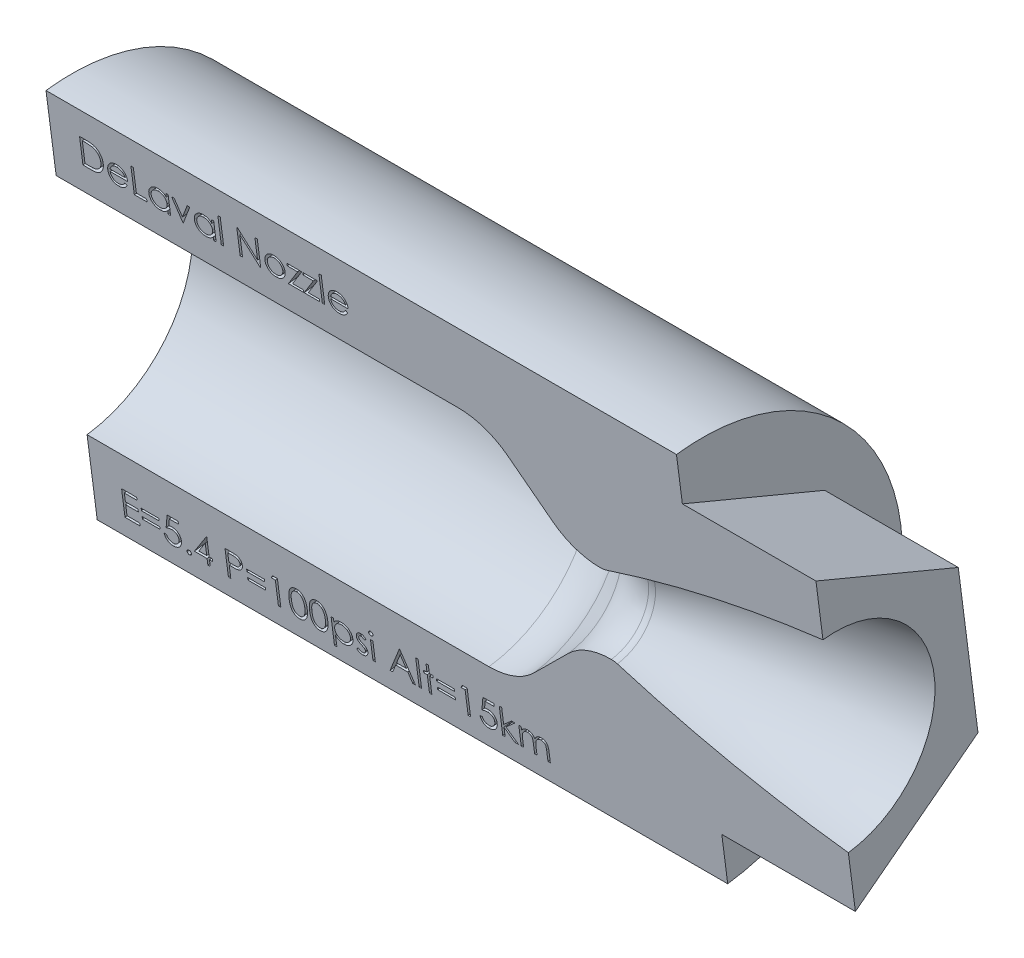
from build123d import *

# Parameters (mm, degrees)
SKETCH3_R          = 9.525
CUT_EXTRUDE2_DEPTH = 6.35
CUT_EXTRUDE3_DEPTH = 39.740118855
SKETCH5_W          = 0.113974359
SKETCH5_H          = 1.302564103
SKETCH5_W_2        = 0.846666667
SKETCH5_H_2        = 0.113974359
SKETCH5_H_3        = 0.928076923
CUT_EXTRUDE4_DEPTH = 0.635


with BuildPart() as part:
    # Sketch1 → Revolve1 (revolve)
    with BuildSketch(Plane.XY, mode=Mode.PRIVATE) as revolve1_sk:
        with BuildLine():
            Line((-2.155261469, 2.924738531), (-4.047950886, 4.817427948))
            ThreePointArc((-4.047950886, 4.817427948), (-5.077995018, 5.505681433), (-6.293014916, 5.747363917))
            Line((-6.293014916, 5.747363917), (-25.4, 5.747363917))
            Line((-25.4, 5.747363917), (-25.4, 9.525))
            Line((-25.4, 9.525), (-1.777203317, 9.525))
            Line((-1.777203317, 9.525), (10.922796683, 9.525))
            Line((10.922796683, 9.525), (10.922796683, 4.721941296))
            add(Edge.make_bspline(
                [(10.922796683, 4.721941296), (5.402180861, 3.94606934), (0.277993972, 2.081017838)],
                knots=[0, 0, 0, 1, 1, 1], degree=2))
            ThreePointArc((0.277993972, 2.081017838), (0.141141239, 2.044348258), (0, 2.032))
            ThreePointArc((0, 2.032), (-1.166419102, 2.264015185), (-2.155261469, 2.924738531))
        make_face()
    revolve(revolve1_sk.sketch.rotate(Axis((0, 0, 0), (1, 0, 0)), 90), axis=Axis((0, 0, 0), (1, 0, 0)))

    # Sketch3 → Cut-Extrude2 (cut)
    with BuildSketch(Plane(origin=(10.922796683, 0, 0), x_dir=(0, 0, -1), z_dir=(1, 0, 0))):
        with Locations(Location((0, 0, 0), (0, 0, 180))):
            Circle(SKETCH3_R)
        Polygon((-5.829170486, -4.447932641), (0.937437419, -7.272176044), (6.766607905, -2.824243403), (5.829170486, 4.447932641), (-0.937437419, 7.272176044), (-6.766607905, 2.824243403), align=None, mode=Mode.SUBTRACT)
    extrude(amount=-CUT_EXTRUDE2_DEPTH, mode=Mode.SUBTRACT)

    # Sketch4 → Cut-Extrude3 (cut, through all)
    with BuildSketch(Plane(origin=(10.922796683, 0, 0), x_dir=(0, 0, -1), z_dir=(1, 0, 0))):
        Polygon((1.606039869, -12.458863309), (-1.428212358, 11.079365395), (-11.497166757, 10.00504812), (-9.100357003, -12.458863309), align=None)
    extrude(amount=-CUT_EXTRUDE3_DEPTH, mode=Mode.SUBTRACT)

    # Sketch5 → Cut-Extrude4 (cut)
    # profile 1 of 38: a face of its own
    with BuildSketch(Plane(origin=(0, 0, 0), x_dir=(1, 0, 0), z_dir=(0, -0.12784954633565995, 0.9917935740373427))):
        with BuildLine():
            Line((-23.967179487, 6.990656526), (-23.967179487, 8.260656526))
            Line((-23.967179487, 8.260656526), (-23.710737179, 8.260656526))
            add(Edge.make_bspline(
                [(-23.710737179, 8.260656526), (-23.688432718, 8.260495937), (-23.645340615, 8.260185678), (-23.583069812, 8.258218488), (-23.52545399, 8.254738519), (-23.472682638, 8.249669576), (-23.424610884, 8.243445476), (-23.381373332, 8.2356439), (-23.342746412, 8.226431621), (-23.318990357, 8.218577415), (-23.30775641, 8.214863257)],
                knots=[0, 0, 0, 0, 1.314313732, 2.53924729, 3.670748893, 4.714932338, 5.66265055, 6.526160246, 7.303039223, 8, 8, 8, 8], degree=3))
            add(Edge.make_bspline(
                [(-23.30775641, 8.214863257), (-23.293062605, 8.209264115), (-23.264008201, 8.198192802), (-23.222639902, 8.177308087), (-23.183696127, 8.153645047), (-23.146968038, 8.127172491), (-23.113294595, 8.097140856), (-23.081360301, 8.064825856), (-23.05247153, 8.029052373), (-23.026016234, 7.990562306), (-23.00216358, 7.949809076), (-22.981430229, 7.906870336), (-22.964211208, 7.861964149), (-22.949917095, 7.815215395), (-22.938651666, 7.766521281), (-22.930965651, 7.715825107), (-22.925896177, 7.66332723), (-22.925386707, 7.627703924), (-22.925128205, 7.609628882)],
                knots=[0, 0, 0, 0, 0.984719456, 1.947108742, 2.898477687, 3.838006223, 4.779231079, 5.722358779, 6.681677486, 7.655904652, 8.64651281, 9.637519902, 10.640069247, 11.656948941, 12.698408672, 13.768548281, 14.867775369, 16, 16, 16, 16], degree=3))
            add(Edge.make_bspline(
                [(-22.925128205, 7.609628882), (-22.92535643, 7.593931233), (-22.925806172, 7.562997375), (-22.929844524, 7.517407679), (-22.935714217, 7.473170468), (-22.944801683, 7.4304964), (-22.955833453, 7.38901159), (-22.969971873, 7.349158175), (-22.986168182, 7.310570564), (-23.005054852, 7.273770509), (-23.025789012, 7.238905971), (-23.048040044, 7.206039994), (-23.071784217, 7.175641556), (-23.097247946, 7.147618602), (-23.124102175, 7.122013378), (-23.152522718, 7.09861199), (-23.18258291, 7.077872326), (-23.214148115, 7.058979404), (-23.248139168, 7.042498303), (-23.285199897, 7.0285537), (-23.325488353, 7.016997928), (-23.368905646, 7.007356488), (-23.415526793, 6.999708439), (-23.465397504, 6.994582576), (-23.518441155, 6.991116226), (-23.554864488, 6.990812735), (-23.573611779, 6.990656526)],
                knots=[0, 0, 0, 0, 1.105936401, 2.179363191, 3.223086493, 4.248585256, 5.251745608, 6.245858792, 7.225916811, 8.198733463, 9.158002045, 10.082870192, 10.993790845, 11.873723703, 12.748670949, 13.606408763, 14.465103618, 15.319838547, 16.196477973, 17.123216899, 18.106603292, 19.147568657, 20.255746949, 21.433717677, 22.679120308, 24, 24, 24, 24], degree=3))
            Line((-23.573611779, 6.990656526), (-23.967179487, 6.990656526))
        make_face()
        with BuildLine():
            Line((-23.853205128, 7.120912937), (-23.707429888, 7.120912937))
            add(Edge.make_bspline(
                [(-23.707429888, 7.120912937), (-23.686482736, 7.12100296), (-23.646193692, 7.121176108), (-23.588260647, 7.122695465), (-23.535327266, 7.125178111), (-23.487386033, 7.128652496), (-23.444464016, 7.133249394), (-23.406471512, 7.138374716), (-23.373533061, 7.144760076), (-23.353601523, 7.150547996), (-23.344391026, 7.153222632)],
                knots=[0, 0, 0, 0, 1.375205317, 2.645023457, 3.804390687, 4.853969522, 5.800190428, 6.637939096, 7.370582563, 8, 8, 8, 8], degree=3))
            add(Edge.make_bspline(
                [(-23.344391026, 7.153222632), (-23.332798334, 7.15730534), (-23.309889843, 7.165373242), (-23.276912992, 7.180089879), (-23.246158307, 7.197522287), (-23.217089812, 7.216899683), (-23.190119855, 7.238905518), (-23.164928818, 7.263061277), (-23.141567422, 7.289489896), (-23.12027703, 7.318158571), (-23.101224017, 7.348888869), (-23.084724456, 7.381378674), (-23.070264043, 7.415272002), (-23.058914383, 7.451089325), (-23.050018728, 7.488510441), (-23.043717827, 7.527537981), (-23.039793627, 7.568164658), (-23.039335901, 7.595797), (-23.039102564, 7.609883289)],
                knots=[0, 0, 0, 0, 0.998632004, 1.973411704, 2.929992603, 3.868527914, 4.809262121, 5.754881198, 6.702106254, 7.672490631, 8.653608572, 9.636854334, 10.631411391, 11.644891563, 12.686317036, 13.754757253, 14.855430412, 16, 16, 16, 16], degree=3))
            add(Edge.make_bspline(
                [(-23.039102564, 7.609883289), (-23.039288814, 7.624736295), (-23.039654704, 7.653915156), (-23.044253668, 7.696728923), (-23.050974347, 7.737906187), (-23.060692998, 7.777449704), (-23.073077632, 7.81543662), (-23.088533402, 7.851656843), (-23.106192432, 7.886492895), (-23.127203071, 7.919140736), (-23.150213872, 7.950017379), (-23.175750989, 7.978303877), (-23.2034087, 8.004064666), (-23.232885345, 8.02770093), (-23.265011664, 8.04826175), (-23.29903086, 8.066653774), (-23.335442004, 8.082262398), (-23.360774039, 8.090564156), (-23.373647837, 8.094783129)],
                knots=[0, 0, 0, 0, 1.122418816, 2.205001699, 3.251619955, 4.274784885, 5.280384055, 6.268708349, 7.249350384, 8.229342522, 9.199999885, 10.157847722, 11.105861043, 12.055065948, 13.010012805, 13.98527497, 14.976112212, 16, 16, 16, 16], degree=3))
            add(Edge.make_bspline(
                [(-23.373647837, 8.094783129), (-23.38429811, 8.097728233), (-23.406943512, 8.103990332), (-23.443896689, 8.110821252), (-23.485485615, 8.116846313), (-23.531894935, 8.121947373), (-23.583071747, 8.12560763), (-23.639055411, 8.128354936), (-23.699870125, 8.130207914), (-23.742027787, 8.130334445), (-23.763908253, 8.130400116)],
                knots=[0, 0, 0, 0, 0.674548936, 1.434276114, 2.292660221, 3.240891867, 4.284742987, 5.42552168, 6.663806718, 8, 8, 8, 8], degree=3))
            Line((-23.763908253, 8.130400116), (-23.853205128, 8.130400116))
            Line((-23.853205128, 8.130400116), (-23.853205128, 7.120912937))
        make_face(mode=Mode.SUBTRACT)
    # profile 2 of 38: a face of its own
    with BuildSketch(Plane(origin=(0, 0, 0), x_dir=(1, 0, 0), z_dir=(0, -0.12784954633565995, 0.9917935740373427))):
        with BuildLine():
            Line((-21.935484776, 7.283733449), (-21.834230769, 7.230562376))
            add(Edge.make_bspline(
                [(-21.834230769, 7.230562376), (-21.842299477, 7.216250081), (-21.857997986, 7.188404024), (-21.884994829, 7.15014732), (-21.913294809, 7.115731149), (-21.944175392, 7.08607496), (-21.976712676, 7.060220886), (-22.011087096, 7.037601161), (-22.04747761, 7.018326727), (-22.085885939, 7.002087952), (-22.126634633, 6.989602222), (-22.16982244, 6.980783261), (-22.215532097, 6.975331961), (-22.246863425, 6.974698724), (-22.262906651, 6.974374475)],
                knots=[0, 0, 0, 0, 1.120438281, 2.179929193, 3.190490725, 4.156257408, 5.095198341, 6.022838206, 6.959905092, 7.901321166, 8.864066838, 9.862729781, 10.905609505, 12, 12, 12, 12], degree=3))
            add(Edge.make_bspline(
                [(-22.262906651, 6.974374475), (-22.280738168, 6.974790736), (-22.315522293, 6.97560274), (-22.366155287, 6.982603149), (-22.413827247, 6.994023119), (-22.458535494, 7.009976329), (-22.50017054, 7.030814244), (-22.538815136, 7.056199542), (-22.574672507, 7.086001817), (-22.60661272, 7.120479212), (-22.635366929, 7.157375237), (-22.660740012, 7.195822086), (-22.681951708, 7.235723028), (-22.699206513, 7.276824047), (-22.713141992, 7.318866088), (-22.722854482, 7.362231678), (-22.728453276, 7.406803447), (-22.729311232, 7.436955909), (-22.72974359, 7.452150917)],
                knots=[0, 0, 0, 0, 1.145258523, 2.234067595, 3.276747158, 4.290159414, 5.277019952, 6.260822364, 7.254936242, 8.264827045, 9.274100331, 10.257902744, 11.220704747, 12.172965371, 13.118907548, 14.062713208, 15.023725156, 16, 16, 16, 16], degree=3))
            add(Edge.make_bspline(
                [(-22.72974359, 7.452150917), (-22.729359273, 7.466409327), (-22.728597607, 7.494667613), (-22.723796721, 7.536492539), (-22.715288341, 7.577142863), (-22.703612932, 7.616652363), (-22.688535765, 7.654954886), (-22.670090932, 7.692073743), (-22.648249697, 7.727969437), (-22.631386756, 7.750612859), (-22.622892628, 7.762018706)],
                knots=[0, 0, 0, 0, 1.024358464, 2.0301432, 3.019427413, 4.004406732, 4.986367066, 5.972626655, 6.978780325, 8, 8, 8, 8], degree=3))
            add(Edge.make_bspline(
                [(-22.622892628, 7.762018706), (-22.611387269, 7.775759696), (-22.588741011, 7.802806396), (-22.550439134, 7.838344017), (-22.508964491, 7.868114187), (-22.464836844, 7.892791062), (-22.417543323, 7.911541214), (-22.367719666, 7.925513965), (-22.314798554, 7.933343701), (-22.278619802, 7.934449629), (-22.260108173, 7.935015501)],
                knots=[0, 0, 0, 0, 1.030682036, 2.02871468, 2.997146059, 3.962720338, 4.930598197, 5.918074684, 6.934738563, 8, 8, 8, 8], degree=3))
            add(Edge.make_bspline(
                [(-22.260108173, 7.935015501), (-22.241077185, 7.934524174), (-22.203742724, 7.933560304), (-22.149302497, 7.924624463), (-22.097791037, 7.910453965), (-22.049228957, 7.890441018), (-22.003611334, 7.864620266), (-21.961234681, 7.83263737), (-21.921374275, 7.795474235), (-21.898184591, 7.766894442), (-21.886384215, 7.752351238)],
                knots=[0, 0, 0, 0, 1.056321875, 2.072262726, 3.055038591, 4.01806755, 4.982017516, 5.957941055, 6.960871419, 8, 8, 8, 8], degree=3))
            add(Edge.make_bspline(
                [(-21.886384215, 7.752351238), (-21.878355297, 7.741391653), (-21.862350905, 7.719545432), (-21.8423041, 7.683923327), (-21.824902417, 7.646654054), (-21.810993028, 7.607135175), (-21.799730123, 7.565834927), (-21.791581506, 7.522458061), (-21.786802816, 7.477017493), (-21.785863489, 7.446056143), (-21.785384615, 7.430271911)],
                knots=[0, 0, 0, 0, 0.94817472, 1.890038105, 2.849395472, 3.817997239, 4.812318967, 5.836947057, 6.897266129, 8, 8, 8, 8], degree=3))
            Line((-21.785384615, 7.430271911), (-22.615769231, 7.430271911))
            add(Edge.make_bspline(
                [(-22.615769231, 7.430271911), (-22.615210574, 7.418043457), (-22.614111997, 7.393996695), (-22.608990216, 7.358810154), (-22.60091709, 7.325291827), (-22.589570887, 7.293693123), (-22.575830632, 7.263601334), (-22.558999243, 7.23523968), (-22.538918891, 7.208737346), (-22.51652128, 7.18385727), (-22.491590419, 7.161700937), (-22.465362108, 7.141870149), (-22.437460729, 7.125249261), (-22.408106282, 7.111758273), (-22.377346234, 7.101196838), (-22.345170894, 7.093987657), (-22.311643578, 7.089159079), (-22.288788754, 7.088622172), (-22.277153446, 7.088348834)],
                knots=[0, 0, 0, 0, 1.094153842, 2.151609401, 3.174256925, 4.172055639, 5.149267565, 6.128595816, 7.11444997, 8.118368179, 9.117203808, 10.09244225, 11.054858984, 12.015122123, 12.976791628, 13.957293641, 14.960065497, 16, 16, 16, 16], degree=3))
            add(Edge.make_bspline(
                [(-22.277153446, 7.088348834), (-22.265777458, 7.088569472), (-22.243205316, 7.089007259), (-22.209589919, 7.093264267), (-22.17651929, 7.100147767), (-22.144130305, 7.109542135), (-22.113080312, 7.121000021), (-22.084325498, 7.134825915), (-22.057880392, 7.150120252), (-22.033163664, 7.167613477), (-22.009189332, 7.189025019), (-21.985406772, 7.215744266), (-21.959906387, 7.247344598), (-21.943944449, 7.271128311), (-21.935484776, 7.283733449)],
                knots=[0, 0, 0, 0, 0.99110716, 1.966546729, 2.947904876, 3.932708344, 4.903319531, 5.828989031, 6.710028674, 7.56322171, 8.463672341, 9.504779593, 10.677557249, 12, 12, 12, 12], degree=3))
        make_face()
        with BuildLine():
            add(Edge.make_bspline(
                [(-21.899358974, 7.54424627), (-21.903530607, 7.559363941), (-21.911559656, 7.588460592), (-21.928336851, 7.628752572), (-21.947231382, 7.664562182), (-21.969591267, 7.695615363), (-21.99492549, 7.723193781), (-22.024188171, 7.747294239), (-22.057003481, 7.768854285), (-22.093201798, 7.787052478), (-22.131534674, 7.802542798), (-22.171668921, 7.812929626), (-22.212620175, 7.820045089), (-22.240318616, 7.820707705), (-22.254256811, 7.821041142)],
                knots=[0, 0, 0, 0, 1.154881502, 2.222775134, 3.210006277, 4.132804581, 5.035138423, 5.962687519, 6.919655026, 7.923214229, 8.944639381, 9.960483929, 10.97369054, 12, 12, 12, 12], degree=3))
            add(Edge.make_bspline(
                [(-22.254256811, 7.821041142), (-22.265632179, 7.820819192), (-22.288118889, 7.820380445), (-22.321248134, 7.816218427), (-22.353063339, 7.809338712), (-22.383799257, 7.799917142), (-22.413053115, 7.787359163), (-22.441426646, 7.772633249), (-22.468198389, 7.754656732), (-22.484941088, 7.740955662), (-22.493399439, 7.73403393)],
                knots=[0, 0, 0, 0, 1.04873581, 2.073130211, 3.073294108, 4.04793562, 5.032784715, 6.005352987, 6.992311501, 8, 8, 8, 8], degree=3))
            add(Edge.make_bspline(
                [(-22.493399439, 7.73403393), (-22.499456716, 7.72855685), (-22.511715167, 7.717472574), (-22.528094728, 7.698375691), (-22.543777585, 7.677782981), (-22.558050082, 7.654906607), (-22.571141092, 7.630007068), (-22.583391141, 7.603294383), (-22.594417067, 7.574565847), (-22.600620513, 7.554546133), (-22.603812099, 7.54424627)],
                knots=[0, 0, 0, 0, 0.879870761, 1.780643979, 2.707998968, 3.669668524, 4.684282772, 5.740141944, 6.837334558, 8, 8, 8, 8], degree=3))
            Line((-22.603812099, 7.54424627), (-21.899358974, 7.54424627))
        make_face(mode=Mode.SUBTRACT)
    # profile 3 of 38: a face of its own
    with BuildSketch(Plane(origin=(0, 0, 0), x_dir=(1, 0, 0), z_dir=(0, -0.12784954633565995, 0.9917935740373427))):
        Polygon((-21.524871795, 8.260656526), (-21.410897436, 8.260656526), (-21.410897436, 7.120912937), (-20.922435897, 7.120912937), (-20.922435897, 6.990656526), (-21.524871795, 6.990656526), align=None)
    # profile 4 of 38: a face of its own
    with BuildSketch(Plane(origin=(0, 0, 0), x_dir=(1, 0, 0), z_dir=(0, -0.12784954633565995, 0.9917935740373427))):
        with BuildLine():
            Line((-19.798974359, 7.918733449), (-19.798974359, 6.990656526))
            Line((-19.798974359, 6.990656526), (-19.912948718, 6.990656526))
            Line((-19.912948718, 6.990656526), (-19.912948718, 7.151187376))
            add(Edge.make_bspline(
                [(-19.912948718, 7.151187376), (-19.925800679, 7.136658723), (-19.950881443, 7.108305875), (-19.992770077, 7.071264629), (-20.037172245, 7.040647353), (-20.083872438, 7.015918669), (-20.132828487, 6.997343266), (-20.183931867, 6.984140288), (-20.237203425, 6.975651668), (-20.273580708, 6.974804025), (-20.292015224, 6.974374475)],
                knots=[0, 0, 0, 0, 1.074387032, 2.096679803, 3.090159297, 4.057316773, 5.018401886, 5.985159533, 6.978961417, 8, 8, 8, 8], degree=3))
            add(Edge.make_bspline(
                [(-20.292015224, 6.974374475), (-20.308404739, 6.974819473), (-20.340725588, 6.975697029), (-20.388270424, 6.982505065), (-20.434023898, 6.993438176), (-20.478029243, 7.008642213), (-20.520001707, 7.028810111), (-20.560300656, 7.052955078), (-20.598717319, 7.081708179), (-20.634666134, 7.114578692), (-20.667770317, 7.150282016), (-20.696821122, 7.188362258), (-20.721042954, 7.228654751), (-20.741297669, 7.270649352), (-20.756899199, 7.314669337), (-20.767775347, 7.360562481), (-20.774575452, 7.408274521), (-20.775452644, 7.440764577), (-20.775897436, 7.457239058)],
                knots=[0, 0, 0, 0, 1.033919861, 2.038935746, 3.024066025, 3.998881131, 4.97069526, 5.957263378, 6.95902576, 7.993208707, 9.027059324, 10.027763471, 11.009749337, 11.988697705, 12.965288445, 13.950418724, 14.960734635, 16, 16, 16, 16], degree=3))
            add(Edge.make_bspline(
                [(-20.775897436, 7.457239058), (-20.775442786, 7.473373031), (-20.774543969, 7.505269024), (-20.767848086, 7.552178723), (-20.756588263, 7.597361063), (-20.740786615, 7.640670583), (-20.720523963, 7.682159687), (-20.695875771, 7.721857719), (-20.66684026, 7.759874043), (-20.633365816, 7.795314745), (-20.59710377, 7.828051939), (-20.558311174, 7.856503222), (-20.517953012, 7.881074764), (-20.475403291, 7.900543311), (-20.431291798, 7.916294615), (-20.385225834, 7.927192292), (-20.337397061, 7.933613891), (-20.304924797, 7.934543808), (-20.288453526, 7.935015501)],
                knots=[0, 0, 0, 0, 1.020392517, 2.01726096, 2.990465484, 3.961182959, 4.928053699, 5.906110375, 6.912531644, 7.948652711, 8.985773172, 9.998621852, 10.987621588, 11.969261332, 12.953316658, 13.946091881, 14.958173133, 16, 16, 16, 16], degree=3))
            add(Edge.make_bspline(
                [(-20.288453526, 7.935015501), (-20.269512434, 7.934493802), (-20.232369847, 7.933470776), (-20.178039969, 7.924957158), (-20.126643259, 7.910574057), (-20.077782965, 7.891009708), (-20.031634545, 7.865011455), (-19.988634891, 7.83221644), (-19.948333987, 7.792831495), (-19.924973138, 7.762579934), (-19.912948718, 7.74700869)],
                knots=[0, 0, 0, 0, 1.038897134, 2.037228247, 3.008116434, 3.962042015, 4.918381754, 5.904844433, 6.921570401, 8, 8, 8, 8], degree=3))
            Line((-19.912948718, 7.74700869), (-19.912948718, 7.918733449))
            Line((-19.912948718, 7.918733449), (-19.798974359, 7.918733449))
        make_face()
        with BuildLine():
            add(Edge.make_bspline(
                [(-20.286927083, 7.821041142), (-20.303587429, 7.820448365), (-20.336472301, 7.819278317), (-20.384748267, 7.810143934), (-20.430944849, 7.79494581), (-20.474830996, 7.774160663), (-20.515713463, 7.748024522), (-20.552250881, 7.716411905), (-20.58474209, 7.680185332), (-20.612068231, 7.63950828), (-20.634344211, 7.595900801), (-20.650007677, 7.550317077), (-20.660337947, 7.503579271), (-20.661393325, 7.471879096), (-20.661923077, 7.455967023)],
                knots=[0, 0, 0, 0, 1.031046209, 2.035121221, 3.029706178, 4.034933723, 5.034054252, 6.02443088, 7.017295772, 8.038157696, 9.050218397, 10.03989886, 11.016116709, 12, 12, 12, 12], degree=3))
            add(Edge.make_bspline(
                [(-20.661923077, 7.455967023), (-20.661246387, 7.440150041), (-20.65989566, 7.408578075), (-20.650188979, 7.361776552), (-20.633903997, 7.316182085), (-20.611681877, 7.272181667), (-20.583855587, 7.231329722), (-20.551601705, 7.194412592), (-20.514608317, 7.16266637), (-20.473631764, 7.136091593), (-20.429868301, 7.11462405), (-20.383845703, 7.099686804), (-20.336429114, 7.090042866), (-20.30418841, 7.088916385), (-20.287944712, 7.088348834)],
                knots=[0, 0, 0, 0, 0.979072187, 1.954306742, 2.945804271, 3.96968567, 4.997920485, 5.998718438, 6.996577872, 8.005894225, 9.015743152, 10.005417472, 10.995077863, 12, 12, 12, 12], degree=3))
            add(Edge.make_bspline(
                [(-20.287944712, 7.088348834), (-20.271454123, 7.088951164), (-20.238655979, 7.090149138), (-20.190236791, 7.099322626), (-20.143248619, 7.114478733), (-20.098331539, 7.135487844), (-20.056488257, 7.161525513), (-20.018933313, 7.192008086), (-19.987177518, 7.227460385), (-19.9602562, 7.266422698), (-19.939146835, 7.309135336), (-19.923770379, 7.354613743), (-19.91467939, 7.4028595), (-19.913533585, 7.435830125), (-19.912948718, 7.452659731)],
                knots=[0, 0, 0, 0, 1.01762866, 2.023962475, 3.030623092, 4.058876274, 5.077231937, 6.066672613, 7.034107872, 8.005628644, 8.981990164, 9.965428785, 10.961468474, 12, 12, 12, 12], degree=3))
            add(Edge.make_bspline(
                [(-19.912948718, 7.452659731), (-19.913296936, 7.465482316), (-19.91398234, 7.490721219), (-19.919218575, 7.527778918), (-19.927547934, 7.563242299), (-19.939284973, 7.597148646), (-19.954703239, 7.629310495), (-19.973298857, 7.659958773), (-19.995398834, 7.688934081), (-20.020647412, 7.715837424), (-20.0482845, 7.740376169), (-20.077528805, 7.762279765), (-20.108726807, 7.780273406), (-20.141353847, 7.795165524), (-20.175466531, 7.80701613), (-20.211342441, 7.81492195), (-20.248600245, 7.82035041), (-20.274016957, 7.820808473), (-20.286927083, 7.821041142)],
                knots=[0, 0, 0, 0, 1.050140795, 2.067009409, 3.05949893, 4.030605086, 5.00011959, 5.97591094, 6.962425594, 7.979863591, 8.993523472, 9.986985069, 10.967611495, 11.937549037, 12.921786183, 13.919465291, 14.943216303, 16, 16, 16, 16], degree=3))
        make_face(mode=Mode.SUBTRACT)
    # profile 5 of 38: a face of its own
    with BuildSketch(Plane(origin=(0, 0, 0), x_dir=(1, 0, 0), z_dir=(0, -0.12784954633565995, 0.9917935740373427))):
        Polygon((-19.636153846, 7.918733449), (-19.512766426, 7.918733449), (-19.204679487, 7.243028321), (-18.896592548, 7.918733449), (-18.773205128, 7.918733449), (-19.196538462, 6.990656526), (-19.212820513, 6.990656526), align=None)
    # profile 6 of 38: a face of its own
    with BuildSketch(Plane(origin=(0, 0, 0), x_dir=(1, 0, 0), z_dir=(0, -0.12784954633565995, 0.9917935740373427))):
        with BuildLine():
            Line((-17.633461538, 7.918733449), (-17.633461538, 6.990656526))
            Line((-17.633461538, 6.990656526), (-17.747435897, 6.990656526))
            Line((-17.747435897, 6.990656526), (-17.747435897, 7.151187376))
            add(Edge.make_bspline(
                [(-17.747435897, 7.151187376), (-17.760287859, 7.136658723), (-17.785368622, 7.108305875), (-17.827257257, 7.071264629), (-17.871659424, 7.040647353), (-17.918359618, 7.015918669), (-17.967315666, 6.997343266), (-18.018419046, 6.984140288), (-18.071690604, 6.975651668), (-18.108067888, 6.974804025), (-18.126502404, 6.974374475)],
                knots=[0, 0, 0, 0, 1.074387032, 2.096679803, 3.090159297, 4.057316773, 5.018401886, 5.985159533, 6.978961417, 8, 8, 8, 8], degree=3))
            add(Edge.make_bspline(
                [(-18.126502404, 6.974374475), (-18.142891919, 6.974819473), (-18.175212767, 6.975697029), (-18.222757604, 6.982505065), (-18.268511077, 6.993438176), (-18.312516422, 7.008642213), (-18.354488886, 7.028810111), (-18.394787836, 7.052955078), (-18.433204498, 7.081708179), (-18.469153314, 7.114578692), (-18.502257497, 7.150282016), (-18.531308301, 7.188362258), (-18.555530133, 7.228654751), (-18.575784848, 7.270649352), (-18.591386379, 7.314669337), (-18.602262526, 7.360562481), (-18.609062631, 7.408274521), (-18.609939824, 7.440764577), (-18.610384615, 7.457239058)],
                knots=[0, 0, 0, 0, 1.033919861, 2.038935746, 3.024066025, 3.998881131, 4.97069526, 5.957263378, 6.95902576, 7.993208707, 9.027059324, 10.027763471, 11.009749337, 11.988697705, 12.965288445, 13.950418724, 14.960734635, 16, 16, 16, 16], degree=3))
            add(Edge.make_bspline(
                [(-18.610384615, 7.457239058), (-18.609929966, 7.473373031), (-18.609031148, 7.505269024), (-18.602335265, 7.552178723), (-18.591075442, 7.597361063), (-18.575273795, 7.640670583), (-18.555011142, 7.682159687), (-18.530362951, 7.721857719), (-18.50132744, 7.759874043), (-18.467852995, 7.795314745), (-18.43159095, 7.828051939), (-18.392798353, 7.856503222), (-18.352440191, 7.881074764), (-18.30989047, 7.900543311), (-18.265778978, 7.916294615), (-18.219713013, 7.927192292), (-18.17188424, 7.933613891), (-18.139411976, 7.934543808), (-18.122940705, 7.935015501)],
                knots=[0, 0, 0, 0, 1.020392517, 2.01726096, 2.990465484, 3.961182959, 4.928053699, 5.906110375, 6.912531644, 7.948652711, 8.985773172, 9.998621852, 10.987621588, 11.969261332, 12.953316658, 13.946091881, 14.958173133, 16, 16, 16, 16], degree=3))
            add(Edge.make_bspline(
                [(-18.122940705, 7.935015501), (-18.103999613, 7.934493802), (-18.066857027, 7.933470776), (-18.012527149, 7.924957158), (-17.961130438, 7.910574057), (-17.912270145, 7.891009708), (-17.866121724, 7.865011455), (-17.82312207, 7.83221644), (-17.782821166, 7.792831495), (-17.759460318, 7.762579934), (-17.747435897, 7.74700869)],
                knots=[0, 0, 0, 0, 1.038897134, 2.037228247, 3.008116434, 3.962042015, 4.918381754, 5.904844433, 6.921570401, 8, 8, 8, 8], degree=3))
            Line((-17.747435897, 7.74700869), (-17.747435897, 7.918733449))
            Line((-17.747435897, 7.918733449), (-17.633461538, 7.918733449))
        make_face()
        with BuildLine():
            add(Edge.make_bspline(
                [(-18.121414263, 7.821041142), (-18.138074608, 7.820448365), (-18.17095948, 7.819278317), (-18.219235447, 7.810143934), (-18.265432028, 7.79494581), (-18.309318175, 7.774160663), (-18.350200643, 7.748024522), (-18.38673806, 7.716411905), (-18.419229269, 7.680185332), (-18.446555411, 7.63950828), (-18.468831391, 7.595900801), (-18.484494857, 7.550317077), (-18.494825127, 7.503579271), (-18.495880504, 7.471879096), (-18.496410256, 7.455967023)],
                knots=[0, 0, 0, 0, 1.031046209, 2.035121221, 3.029706178, 4.034933723, 5.034054252, 6.02443088, 7.017295772, 8.038157696, 9.050218397, 10.03989886, 11.016116709, 12, 12, 12, 12], degree=3))
            add(Edge.make_bspline(
                [(-18.496410256, 7.455967023), (-18.495733567, 7.440150041), (-18.494382839, 7.408578075), (-18.484676159, 7.361776552), (-18.468391176, 7.316182085), (-18.446169056, 7.272181667), (-18.418342767, 7.231329722), (-18.386088884, 7.194412592), (-18.349095496, 7.16266637), (-18.308118944, 7.136091593), (-18.26435548, 7.11462405), (-18.218332882, 7.099686804), (-18.170916294, 7.090042866), (-18.13867559, 7.088916385), (-18.122431891, 7.088348834)],
                knots=[0, 0, 0, 0, 0.979072187, 1.954306742, 2.945804271, 3.96968567, 4.997920485, 5.998718438, 6.996577872, 8.005894225, 9.015743152, 10.005417472, 10.995077863, 12, 12, 12, 12], degree=3))
            add(Edge.make_bspline(
                [(-18.122431891, 7.088348834), (-18.105941303, 7.088951164), (-18.073143159, 7.090149138), (-18.02472397, 7.099322626), (-17.977735798, 7.114478733), (-17.932818718, 7.135487844), (-17.890975436, 7.161525513), (-17.853420492, 7.192008086), (-17.821664698, 7.227460385), (-17.79474338, 7.266422698), (-17.773634014, 7.309135336), (-17.758257558, 7.354613743), (-17.74916657, 7.4028595), (-17.748020765, 7.435830125), (-17.747435897, 7.452659731)],
                knots=[0, 0, 0, 0, 1.01762866, 2.023962475, 3.030623092, 4.058876274, 5.077231937, 6.066672613, 7.034107872, 8.005628644, 8.981990164, 9.965428785, 10.961468474, 12, 12, 12, 12], degree=3))
            add(Edge.make_bspline(
                [(-17.747435897, 7.452659731), (-17.747784116, 7.465482316), (-17.748469519, 7.490721219), (-17.753705754, 7.527778918), (-17.762035113, 7.563242299), (-17.773772152, 7.597148646), (-17.789190418, 7.629310495), (-17.807786036, 7.659958773), (-17.829886014, 7.688934081), (-17.855134592, 7.715837424), (-17.88277168, 7.740376169), (-17.912015984, 7.762279765), (-17.943213987, 7.780273406), (-17.975841026, 7.795165524), (-18.00995371, 7.80701613), (-18.045829621, 7.81492195), (-18.083087425, 7.82035041), (-18.108504136, 7.820808473), (-18.121414263, 7.821041142)],
                knots=[0, 0, 0, 0, 1.050140795, 2.067009409, 3.05949893, 4.030605086, 5.00011959, 5.97591094, 6.962425594, 7.979863591, 8.993523472, 9.986985069, 10.967611495, 11.937549037, 12.921786183, 13.919465291, 14.943216303, 16, 16, 16, 16], degree=3))
        make_face(mode=Mode.SUBTRACT)
    # profile 7 of 38: a face of its own
    with BuildSketch(Plane(origin=(0, 0, 0), x_dir=(1, 0, 0), z_dir=(0, -0.12784954633565995, 0.9917935740373427))):
        with Locations((-17.33224359, 7.641938578)):
            Rectangle(SKETCH5_W, SKETCH5_H)
    # profile 8 of 38: a face of its own
    with BuildSketch(Plane(origin=(0, 0, 0), x_dir=(1, 0, 0), z_dir=(0, -0.12784954633565995, 0.9917935740373427))):
        Polygon((-16.493717949, 6.990656526), (-16.493717949, 8.260656526), (-16.469803686, 8.260656526), (-15.630769231, 7.261091222), (-15.630769231, 8.260656526), (-15.516794872, 8.260656526), (-15.516794872, 6.990656526), (-15.542744391, 6.990656526), (-16.37974359, 7.987932167), (-16.37974359, 6.990656526), align=None)
    # profile 9 of 38: a face of its own
    with BuildSketch(Plane(origin=(0, 0, 0), x_dir=(1, 0, 0), z_dir=(0, -0.12784954633565995, 0.9917935740373427))):
        with BuildLine():
            add(Edge.make_bspline(
                [(-14.775452724, 7.935015501), (-14.758038748, 7.9346447), (-14.723894197, 7.933917651), (-14.673889621, 7.926147078), (-14.626157529, 7.914264463), (-14.580515111, 7.897837353), (-14.537546912, 7.875818474), (-14.49662706, 7.849544245), (-14.457867746, 7.818417419), (-14.434636532, 7.794338919), (-14.422844551, 7.782116863)],
                knots=[0, 0, 0, 0, 1.054011418, 2.066658804, 3.057071809, 4.030435133, 4.997543892, 5.974964718, 6.972108034, 8, 8, 8, 8], degree=3))
            add(Edge.make_bspline(
                [(-14.422844551, 7.782116863), (-14.412691099, 7.770427788), (-14.392580693, 7.747275854), (-14.366793989, 7.709736246), (-14.344579309, 7.670859695), (-14.326776463, 7.630129951), (-14.312739326, 7.58790257), (-14.302773202, 7.544032412), (-14.296845228, 7.49861636), (-14.296045866, 7.46777211), (-14.295641026, 7.452150917)],
                knots=[0, 0, 0, 0, 1.025258237, 2.030674902, 3.01204498, 3.988269485, 4.97094183, 5.956517959, 6.965070386, 8, 8, 8, 8], degree=3))
            add(Edge.make_bspline(
                [(-14.295641026, 7.452150917), (-14.295997111, 7.436439182), (-14.296700752, 7.405392061), (-14.303356864, 7.359665034), (-14.313709573, 7.315325769), (-14.328525697, 7.272559901), (-14.347524211, 7.231236703), (-14.370707403, 7.191536667), (-14.398237961, 7.153381464), (-14.429445126, 7.117095083), (-14.463935378, 7.083651913), (-14.501351809, 7.054504227), (-14.54095913, 7.029531845), (-14.583284004, 7.009416346), (-14.62793992, 6.993555969), (-14.675023199, 6.982416249), (-14.724460696, 6.975681009), (-14.758216288, 6.974816113), (-14.775452724, 6.974374475)],
                knots=[0, 0, 0, 0, 0.998656419, 1.973391657, 2.932242238, 3.890759089, 4.846373663, 5.82037756, 6.809684879, 7.83454468, 8.860553229, 9.859544525, 10.845671541, 11.83227036, 12.833544569, 13.85385346, 14.904124723, 16, 16, 16, 16], degree=3))
            add(Edge.make_bspline(
                [(-14.775452724, 6.974374475), (-14.792773608, 6.974817595), (-14.826697435, 6.975685467), (-14.876309434, 6.982390081), (-14.923477095, 6.993550835), (-14.968191473, 7.009468468), (-15.010698317, 7.029532488), (-15.050535132, 7.05442873), (-15.087981958, 7.083660558), (-15.122479507, 7.117092741), (-15.153684715, 7.153382068), (-15.181215778, 7.19153651), (-15.204398839, 7.231236744), (-15.223397388, 7.27255989), (-15.238213502, 7.315325772), (-15.248566213, 7.359665033), (-15.255222325, 7.405392061), (-15.255925966, 7.436439182), (-15.256282051, 7.452150917)],
                knots=[0, 0, 0, 0, 1.099876186, 2.154163076, 3.173186993, 4.173200201, 5.163417411, 6.152872554, 7.150605724, 8.17532212, 9.198891216, 10.186952605, 11.159729845, 12.11414092, 13.071450619, 14.029093627, 15.002601286, 16, 16, 16, 16], degree=3))
            add(Edge.make_bspline(
                [(-15.256282051, 7.452150917), (-15.25587445, 7.467687207), (-15.25506747, 7.49844639), (-15.249145457, 7.543777066), (-15.239218209, 7.587572976), (-15.225164245, 7.629637363), (-15.207197304, 7.670188621), (-15.18529478, 7.709161231), (-15.159245036, 7.74653109), (-15.139214614, 7.769653102), (-15.129078526, 7.781353642)],
                knots=[0, 0, 0, 0, 1.031353054, 2.041901799, 3.029428768, 4.008703097, 4.981709435, 5.96992636, 6.972712378, 8, 8, 8, 8], degree=3))
            add(Edge.make_bspline(
                [(-15.129078526, 7.781353642), (-15.117304323, 7.793681691), (-15.094148281, 7.817926969), (-15.055196028, 7.848963057), (-15.014376841, 7.875784032), (-14.970933797, 7.897365402), (-14.925328874, 7.914361092), (-14.877352177, 7.926177722), (-14.827177919, 7.933889654), (-14.792866285, 7.934636478), (-14.775452724, 7.935015501)],
                knots=[0, 0, 0, 0, 1.027980169, 2.021703884, 2.998553061, 3.971491411, 4.943284454, 5.930300938, 6.949603206, 8, 8, 8, 8], degree=3))
        make_face()
        with BuildLine():
            add(Edge.make_bspline(
                [(-14.775961538, 7.821041142), (-14.788276043, 7.820691133), (-14.812587156, 7.82000015), (-14.848371976, 7.814744562), (-14.882821689, 7.806417896), (-14.916001653, 7.794587281), (-14.947799975, 7.779311395), (-14.978247101, 7.760548647), (-15.007432587, 7.738547546), (-15.034785507, 7.71334252), (-15.059888803, 7.685809284), (-15.081833669, 7.65647288), (-15.100493636, 7.625809149), (-15.116038494, 7.593786203), (-15.127616245, 7.560079527), (-15.136024741, 7.525070841), (-15.141275371, 7.488688819), (-15.141959857, 7.463956106), (-15.142307692, 7.451387696)],
                knots=[0, 0, 0, 0, 1.021534396, 2.016698045, 2.994645724, 3.958388632, 4.93408049, 5.916473867, 6.921342795, 7.962252576, 8.998418191, 10.008913653, 10.997312074, 11.973003931, 12.956656626, 13.948281152, 14.957379055, 16, 16, 16, 16], degree=3))
            add(Edge.make_bspline(
                [(-15.142307692, 7.451387696), (-15.141724645, 7.435149104), (-15.140567405, 7.402918534), (-15.131156619, 7.355452783), (-15.115413597, 7.309884511), (-15.094154784, 7.266480851), (-15.067518814, 7.226322625), (-15.036136364, 7.190518972), (-15.000344244, 7.159608692), (-14.960569114, 7.133961642), (-14.917623404, 7.113583673), (-14.872173253, 7.099142331), (-14.824769344, 7.089754602), (-14.792373193, 7.088821525), (-14.775961538, 7.088348834)],
                knots=[0, 0, 0, 0, 1.016792936, 2.018143844, 3.017858371, 4.030088057, 5.03801393, 6.028138512, 7.003788237, 7.991172063, 8.984598303, 9.972568034, 10.972917682, 12, 12, 12, 12], degree=3))
            add(Edge.make_bspline(
                [(-14.775961538, 7.088348834), (-14.759550827, 7.088824279), (-14.72715654, 7.089762793), (-14.679818496, 7.09909505), (-14.634492569, 7.11364695), (-14.591591465, 7.133938723), (-14.551834441, 7.159706085), (-14.515784902, 7.190344428), (-14.484670406, 7.226417454), (-14.458060784, 7.266534043), (-14.436453823, 7.309817222), (-14.42078449, 7.355461194), (-14.41135108, 7.402916392), (-14.410196894, 7.435148386), (-14.409615385, 7.451387696)],
                knots=[0, 0, 0, 0, 1.02726834, 2.027799167, 3.010890988, 4.004497153, 4.992059811, 5.971914811, 6.958719428, 7.966827853, 8.981595046, 9.981490638, 10.983022906, 12, 12, 12, 12], degree=3))
            add(Edge.make_bspline(
                [(-14.409615385, 7.451387696), (-14.4099631, 7.463956181), (-14.41064735, 7.488689042), (-14.415899694, 7.525069989), (-14.424301847, 7.560082654), (-14.435902977, 7.593774667), (-14.45138029, 7.625892061), (-14.470400098, 7.656382848), (-14.492255356, 7.685910909), (-14.517661568, 7.713253516), (-14.544985937, 7.738557372), (-14.574183251, 7.760557179), (-14.604585229, 7.779228935), (-14.636291172, 7.794717942), (-14.669475389, 7.806310263), (-14.703876833, 7.814792641), (-14.739508973, 7.81997794), (-14.763732968, 7.820684475), (-14.775961538, 7.821041142)],
                knots=[0, 0, 0, 0, 1.042956736, 2.052379634, 3.044323526, 4.02829302, 5.004299113, 5.996692471, 7.007513377, 8.048758398, 9.090003419, 10.095195979, 11.07790575, 12.047570684, 13.018257071, 13.989683339, 14.985167495, 16, 16, 16, 16], degree=3))
        make_face(mode=Mode.SUBTRACT)
    # profile 10 of 38: a face of its own
    with BuildSketch(Plane(origin=(0, 0, 0), x_dir=(1, 0, 0), z_dir=(0, -0.12784954633565995, 0.9917935740373427))):
        Polygon((-14.149102564, 7.918733449), (-13.448974359, 7.918733449), (-13.988826122, 7.104630885), (-13.46525641, 7.104630885), (-13.46525641, 6.990656526), (-14.197948718, 6.990656526), (-13.657842548, 7.80475909), (-14.149102564, 7.80475909), align=None)
    # profile 11 of 38: a face of its own
    with BuildSketch(Plane(origin=(0, 0, 0), x_dir=(1, 0, 0), z_dir=(0, -0.12784954633565995, 0.9917935740373427))):
        Polygon((-13.400128205, 7.918733449), (-12.7, 7.918733449), (-13.239851763, 7.104630885), (-12.716282051, 7.104630885), (-12.716282051, 6.990656526), (-13.448974359, 6.990656526), (-12.908868189, 7.80475909), (-13.400128205, 7.80475909), align=None)
    # profile 12 of 38: a face of its own
    with BuildSketch(Plane(origin=(0, 0, 0), x_dir=(1, 0, 0), z_dir=(0, -0.12784954633565995, 0.9917935740373427))):
        with Locations((-12.529038462, 7.641938578)):
            Rectangle(SKETCH5_W, SKETCH5_H)
    # profile 13 of 38: a face of its own
    with BuildSketch(Plane(origin=(0, 0, 0), x_dir=(1, 0, 0), z_dir=(0, -0.12784954633565995, 0.9917935740373427))):
        with BuildLine():
            Line((-11.44984375, 7.283733449), (-11.348589744, 7.230562376))
            add(Edge.make_bspline(
                [(-11.348589744, 7.230562376), (-11.356658451, 7.216250081), (-11.37235696, 7.188404024), (-11.399353803, 7.15014732), (-11.427653784, 7.115731149), (-11.458534366, 7.08607496), (-11.49107165, 7.060220886), (-11.52544607, 7.037601161), (-11.561836584, 7.018326727), (-11.600244913, 7.002087952), (-11.640993607, 6.989602222), (-11.684181415, 6.980783261), (-11.729891072, 6.975331961), (-11.7612224, 6.974698724), (-11.777265625, 6.974374475)],
                knots=[0, 0, 0, 0, 1.120438281, 2.179929193, 3.190490725, 4.156257408, 5.095198341, 6.022838206, 6.959905092, 7.901321166, 8.864066838, 9.862729781, 10.905609505, 12, 12, 12, 12], degree=3))
            add(Edge.make_bspline(
                [(-11.777265625, 6.974374475), (-11.795097143, 6.974790736), (-11.829881268, 6.97560274), (-11.880514261, 6.982603149), (-11.928186222, 6.994023119), (-11.972894468, 7.009976329), (-12.014529514, 7.030814244), (-12.05317411, 7.056199542), (-12.089031481, 7.086001817), (-12.120971694, 7.120479212), (-12.149725903, 7.157375237), (-12.175098986, 7.195822086), (-12.196310683, 7.235723028), (-12.213565487, 7.276824047), (-12.227500967, 7.318866088), (-12.237213456, 7.362231678), (-12.24281225, 7.406803447), (-12.243670206, 7.436955909), (-12.244102564, 7.452150917)],
                knots=[0, 0, 0, 0, 1.145258523, 2.234067595, 3.276747158, 4.290159414, 5.277019952, 6.260822364, 7.254936242, 8.264827045, 9.274100331, 10.257902744, 11.220704747, 12.172965371, 13.118907548, 14.062713208, 15.023725156, 16, 16, 16, 16], degree=3))
            add(Edge.make_bspline(
                [(-12.244102564, 7.452150917), (-12.243718247, 7.466409327), (-12.242956582, 7.494667613), (-12.238155696, 7.536492539), (-12.229647315, 7.577142863), (-12.217971906, 7.616652363), (-12.20289474, 7.654954886), (-12.184449906, 7.692073743), (-12.162608672, 7.727969437), (-12.14574573, 7.750612859), (-12.137251603, 7.762018706)],
                knots=[0, 0, 0, 0, 1.024358464, 2.0301432, 3.019427413, 4.004406732, 4.986367066, 5.972626655, 6.978780325, 8, 8, 8, 8], degree=3))
            add(Edge.make_bspline(
                [(-12.137251603, 7.762018706), (-12.125746243, 7.775759696), (-12.103099986, 7.802806396), (-12.064798108, 7.838344017), (-12.023323465, 7.868114187), (-11.979195818, 7.892791062), (-11.931902298, 7.911541214), (-11.882078641, 7.925513965), (-11.829157528, 7.933343701), (-11.792978776, 7.934449629), (-11.774467147, 7.935015501)],
                knots=[0, 0, 0, 0, 1.030682036, 2.02871468, 2.997146059, 3.962720338, 4.930598197, 5.918074684, 6.934738563, 8, 8, 8, 8], degree=3))
            add(Edge.make_bspline(
                [(-11.774467147, 7.935015501), (-11.755436159, 7.934524174), (-11.718101699, 7.933560304), (-11.663661472, 7.924624463), (-11.612150012, 7.910453965), (-11.563587932, 7.890441018), (-11.517970308, 7.864620266), (-11.475593656, 7.83263737), (-11.43573325, 7.795474235), (-11.412543565, 7.766894442), (-11.400743189, 7.752351238)],
                knots=[0, 0, 0, 0, 1.056321875, 2.072262726, 3.055038591, 4.01806755, 4.982017516, 5.957941055, 6.960871419, 8, 8, 8, 8], degree=3))
            add(Edge.make_bspline(
                [(-11.400743189, 7.752351238), (-11.392714271, 7.741391653), (-11.376709879, 7.719545432), (-11.356663074, 7.683923327), (-11.339261391, 7.646654054), (-11.325352002, 7.607135175), (-11.314089098, 7.565834927), (-11.30594048, 7.522458061), (-11.30116179, 7.477017493), (-11.300222463, 7.446056143), (-11.29974359, 7.430271911)],
                knots=[0, 0, 0, 0, 0.94817472, 1.890038105, 2.849395472, 3.817997239, 4.812318967, 5.836947057, 6.897266129, 8, 8, 8, 8], degree=3))
            Line((-11.29974359, 7.430271911), (-12.130128205, 7.430271911))
            add(Edge.make_bspline(
                [(-12.130128205, 7.430271911), (-12.129569548, 7.418043457), (-12.128470971, 7.393996695), (-12.123349191, 7.358810154), (-12.115276064, 7.325291827), (-12.103929861, 7.293693123), (-12.090189606, 7.263601334), (-12.073358217, 7.23523968), (-12.053277865, 7.208737346), (-12.030880254, 7.18385727), (-12.005949394, 7.161700937), (-11.979721083, 7.141870149), (-11.951819703, 7.125249261), (-11.922465256, 7.111758273), (-11.891705208, 7.101196838), (-11.859529869, 7.093987657), (-11.826002552, 7.089159079), (-11.803147729, 7.088622172), (-11.79151242, 7.088348834)],
                knots=[0, 0, 0, 0, 1.094153842, 2.151609401, 3.174256925, 4.172055639, 5.149267565, 6.128595816, 7.11444997, 8.118368179, 9.117203808, 10.09244225, 11.054858984, 12.015122123, 12.976791628, 13.957293641, 14.960065497, 16, 16, 16, 16], degree=3))
            add(Edge.make_bspline(
                [(-11.79151242, 7.088348834), (-11.780136432, 7.088569472), (-11.75756429, 7.089007259), (-11.723948893, 7.093264267), (-11.690878265, 7.100147767), (-11.658489279, 7.109542135), (-11.627439287, 7.121000021), (-11.598684473, 7.134825915), (-11.572239366, 7.150120252), (-11.547522638, 7.167613477), (-11.523548306, 7.189025019), (-11.499765747, 7.215744266), (-11.474265361, 7.247344598), (-11.458303423, 7.271128311), (-11.44984375, 7.283733449)],
                knots=[0, 0, 0, 0, 0.99110716, 1.966546729, 2.947904876, 3.932708344, 4.903319531, 5.828989031, 6.710028674, 7.56322171, 8.463672341, 9.504779593, 10.677557249, 12, 12, 12, 12], degree=3))
        make_face()
        with BuildLine():
            add(Edge.make_bspline(
                [(-11.413717949, 7.54424627), (-11.417889581, 7.559363941), (-11.42591863, 7.588460592), (-11.442695826, 7.628752572), (-11.461590356, 7.664562182), (-11.483950241, 7.695615363), (-11.509284465, 7.723193781), (-11.538547145, 7.747294239), (-11.571362455, 7.768854285), (-11.607560772, 7.787052478), (-11.645893648, 7.802542798), (-11.686027895, 7.812929626), (-11.72697915, 7.820045089), (-11.754677591, 7.820707705), (-11.768615785, 7.821041142)],
                knots=[0, 0, 0, 0, 1.154881502, 2.222775134, 3.210006277, 4.132804581, 5.035138423, 5.962687519, 6.919655026, 7.923214229, 8.944639381, 9.960483929, 10.97369054, 12, 12, 12, 12], degree=3))
            add(Edge.make_bspline(
                [(-11.768615785, 7.821041142), (-11.779991153, 7.820819192), (-11.802477863, 7.820380445), (-11.835607108, 7.816218427), (-11.867422313, 7.809338712), (-11.898158232, 7.799917142), (-11.92741209, 7.787359163), (-11.95578562, 7.772633249), (-11.982557364, 7.754656732), (-11.999300062, 7.740955662), (-12.007758413, 7.73403393)],
                knots=[0, 0, 0, 0, 1.04873581, 2.073130211, 3.073294108, 4.04793562, 5.032784715, 6.005352987, 6.992311501, 8, 8, 8, 8], degree=3))
            add(Edge.make_bspline(
                [(-12.007758413, 7.73403393), (-12.01381569, 7.72855685), (-12.026074142, 7.717472574), (-12.042453702, 7.698375691), (-12.05813656, 7.677782981), (-12.072409056, 7.654906607), (-12.085500066, 7.630007068), (-12.097750115, 7.603294383), (-12.108776042, 7.574565847), (-12.114979487, 7.554546133), (-12.118171074, 7.54424627)],
                knots=[0, 0, 0, 0, 0.879870761, 1.780643979, 2.707998968, 3.669668524, 4.684282772, 5.740141944, 6.837334558, 8, 8, 8, 8], degree=3))
            Line((-12.118171074, 7.54424627), (-11.413717949, 7.54424627))
        make_face(mode=Mode.SUBTRACT)
    # profile 14 of 38: a face of its own
    with BuildSketch(Plane(origin=(0, 0, 0), x_dir=(1, 0, 0), z_dir=(0, -0.12784954633565995, 0.9917935740373427))):
        Polygon((-23.967179487, -7.370996923), (-23.250769231, -7.370996923), (-23.250769231, -7.501253333), (-23.853205128, -7.501253333), (-23.853205128, -7.892022564), (-23.250769231, -7.892022564), (-23.250769231, -8.022278974), (-23.853205128, -8.022278974), (-23.853205128, -8.510740513), (-23.250769231, -8.510740513), (-23.250769231, -8.640996923), (-23.967179487, -8.640996923), align=None)
    # profile 15 of 38: a face of its own
    with BuildSketch(Plane(origin=(0, 0, 0), x_dir=(1, 0, 0), z_dir=(0, -0.12784954633565995, 0.9917935740373427))):
        with Locations((-22.664615385, -7.818753334)):
            Rectangle(SKETCH5_W_2, SKETCH5_H_2)
    # profile 16 of 38: a face of its own
    with BuildSketch(Plane(origin=(0, 0, 0), x_dir=(1, 0, 0), z_dir=(0, -0.12784954633565995, 0.9917935740373427))):
        with Locations((-22.664615385, -8.193240513)):
            Rectangle(SKETCH5_W_2, SKETCH5_H_2)
    # profile 17 of 38: a face of its own
    with BuildSketch(Plane(origin=(0, 0, 0), x_dir=(1, 0, 0), z_dir=(0, -0.12784954633565995, 0.9917935740373427))):
        with BuildLine():
            Line((-21.280641026, -7.370996923), (-21.280641026, -7.501253333))
            Line((-21.280641026, -7.501253333), (-21.712624199, -7.501253333))
            Line((-21.712624199, -7.501253333), (-21.781059696, -7.835289791))
            add(Edge.make_bspline(
                [(-21.781059696, -7.835289791), (-21.767613707, -7.831577664), (-21.74156423, -7.824386005), (-21.703115938, -7.816401054), (-21.666615338, -7.811587593), (-21.642929704, -7.810930346), (-21.631468349, -7.810612307)],
                knots=[0, 0, 0, 0, 1.100273476, 2.13160584, 3.095893838, 4, 4, 4, 4], degree=3))
            add(Edge.make_bspline(
                [(-21.631468349, -7.810612307), (-21.617286535, -7.810919261), (-21.589401545, -7.811522809), (-21.54860227, -7.817318309), (-21.509655763, -7.826440506), (-21.472643475, -7.839184239), (-21.437496932, -7.855480056), (-21.404539503, -7.87583632), (-21.373276488, -7.899615557), (-21.344268747, -7.926955033), (-21.317952784, -7.957043734), (-21.294814839, -7.989395304), (-21.275161556, -8.023695342), (-21.259355225, -8.060271563), (-21.246733481, -8.098719598), (-21.238332614, -8.139443993), (-21.232738552, -8.182060882), (-21.232113571, -8.211199969), (-21.231794872, -8.226059022)],
                knots=[0, 0, 0, 0, 1.052922333, 2.070308379, 3.05430497, 4.020497103, 4.973039431, 5.925935799, 6.892292201, 7.88610001, 8.88166317, 9.857072816, 10.836096531, 11.812156883, 12.81219415, 13.836441305, 14.89672472, 16, 16, 16, 16], degree=3))
            add(Edge.make_bspline(
                [(-21.231794872, -8.226059022), (-21.232036199, -8.236408514), (-21.232515592, -8.256967632), (-21.23495348, -8.287499956), (-21.239647297, -8.317385898), (-21.2459493, -8.346629423), (-21.254128977, -8.375175167), (-21.264031005, -8.403104836), (-21.276148992, -8.430244593), (-21.289440948, -8.456851236), (-21.304407528, -8.482323266), (-21.321018586, -8.50614447), (-21.33856835, -8.528672195), (-21.357451938, -8.549664835), (-21.377844871, -8.568984444), (-21.399500173, -8.586745678), (-21.422245045, -8.603248904), (-21.446431376, -8.61782422), (-21.47152022, -8.631236493), (-21.497873887, -8.642239605), (-21.524892484, -8.652076854), (-21.552964882, -8.659918025), (-21.582027494, -8.666062123), (-21.612128227, -8.670235199), (-21.643109213, -8.673274649), (-21.664109575, -8.673464915), (-21.674717548, -8.673561025)],
                knots=[0, 0, 0, 0, 1.056347294, 2.098418968, 3.122841568, 4.141288669, 5.149314143, 6.15115421, 7.162517403, 8.180376062, 9.185164535, 10.17417709, 11.141909838, 12.097768115, 13.052685741, 14.0056014, 14.954263652, 15.917497458, 16.885230207, 17.854509472, 18.828990115, 19.81800267, 20.826176721, 21.857883937, 22.917946725, 24, 24, 24, 24], degree=3))
            add(Edge.make_bspline(
                [(-21.674717548, -8.673561025), (-21.687371894, -8.67331035), (-21.712267824, -8.672817175), (-21.748742429, -8.667657896), (-21.783836015, -8.660268704), (-21.81726608, -8.649152115), (-21.849332224, -8.635223011), (-21.879602753, -8.617618571), (-21.908851135, -8.597669011), (-21.93588836, -8.574126711), (-21.96098215, -8.548394449), (-21.983445369, -8.52046982), (-22.003450981, -8.490813708), (-22.02067862, -8.459282092), (-22.035373617, -8.425957825), (-22.046917912, -8.39071605), (-22.056235487, -8.353740906), (-22.060177357, -8.328285204), (-22.062179487, -8.315355897)],
                knots=[0, 0, 0, 0, 1.0467383, 2.05933395, 3.04377827, 4.011590433, 4.970194871, 5.932262533, 6.905835911, 7.896367577, 8.894135286, 9.877477877, 10.858688626, 11.851381753, 12.8477658, 13.868841284, 14.917554742, 16, 16, 16, 16], degree=3))
            Line((-22.062179487, -8.315355897), (-21.948205128, -8.315355897))
            add(Edge.make_bspline(
                [(-21.948205128, -8.315355897), (-21.945400766, -8.327466781), (-21.940010626, -8.350744573), (-21.928179397, -8.383449374), (-21.913713779, -8.412593778), (-21.896512773, -8.438563313), (-21.875993191, -8.461208863), (-21.852578226, -8.481389911), (-21.826326338, -8.499596315), (-21.797155081, -8.514772005), (-21.766380049, -8.527714667), (-21.734170233, -8.536333139), (-21.701402656, -8.542393178), (-21.679239933, -8.542999788), (-21.668102965, -8.543304615)],
                knots=[0, 0, 0, 0, 1.136247022, 2.183929868, 3.172523383, 4.106158343, 5.02341133, 5.958108904, 6.928429099, 7.938127109, 8.96079061, 9.975095812, 10.982467395, 12, 12, 12, 12], degree=3))
            add(Edge.make_bspline(
                [(-21.668102965, -8.543304615), (-21.657232329, -8.54300679), (-21.635827959, -8.54242037), (-21.604327827, -8.537906785), (-21.573915727, -8.530955324), (-21.544891743, -8.520552262), (-21.516747985, -8.507908607), (-21.490196359, -8.491683423), (-21.464468744, -8.473010787), (-21.440364821, -8.451617953), (-21.418288793, -8.428043235), (-21.398783, -8.402832867), (-21.382535377, -8.37593904), (-21.368843286, -8.347827353), (-21.358446232, -8.318189705), (-21.351029076, -8.287164993), (-21.34667368, -8.254676586), (-21.346074538, -8.23251715), (-21.345769231, -8.221225288)],
                knots=[0, 0, 0, 0, 1.027316725, 2.022795036, 3.002884548, 3.971462791, 4.93288096, 5.914575861, 6.907176829, 7.935150275, 8.956128384, 9.956726525, 10.942570165, 11.921478529, 12.907843606, 13.90538589, 14.932640048, 16, 16, 16, 16], degree=3))
            add(Edge.make_bspline(
                [(-21.345769231, -8.221225288), (-21.346008165, -8.211037801), (-21.346475844, -8.191097245), (-21.350296937, -8.161923819), (-21.356943381, -8.134320172), (-21.366168617, -8.108153007), (-21.377881467, -8.083397643), (-21.392194843, -8.060028533), (-21.409377362, -8.038353685), (-21.42900499, -8.018362958), (-21.450507194, -7.999913532), (-21.474253923, -7.984185821), (-21.499748239, -7.970954628), (-21.52668298, -7.95953624), (-21.555698814, -7.951335398), (-21.586221135, -7.94517848), (-21.618579541, -7.941616905), (-21.640703191, -7.941122734), (-21.652075321, -7.940868718)],
                knots=[0, 0, 0, 0, 1.045622112, 2.046656509, 3.013763289, 3.955457236, 4.890082067, 5.820317437, 6.762574623, 7.722996705, 8.69280354, 9.665887285, 10.63943826, 11.638615906, 12.663482002, 13.728887084, 14.832589034, 16, 16, 16, 16], degree=3))
            add(Edge.make_bspline(
                [(-21.652075321, -7.940868718), (-21.661919246, -7.941079389), (-21.682244455, -7.941514373), (-21.713422166, -7.94471713), (-21.746185163, -7.94988396), (-21.780407851, -7.95699097), (-21.816193007, -7.966291389), (-21.853465113, -7.977436365), (-21.892302535, -7.990761204), (-21.918470967, -8.000824036), (-21.931923077, -8.005996923)],
                knots=[0, 0, 0, 0, 0.817624296, 1.688186739, 2.600797293, 3.572016777, 4.590301741, 5.671205678, 6.80286297, 8, 8, 8, 8], degree=3))
            Line((-21.931923077, -8.005996923), (-21.801666667, -7.370996923))
            Line((-21.801666667, -7.370996923), (-21.280641026, -7.370996923))
        make_face()
    # profile 18 of 38: a face of its own
    with BuildSketch(Plane(origin=(0, 0, 0), x_dir=(1, 0, 0), z_dir=(0, -0.12784954633565995, 0.9917935740373427))):
        with BuildLine():
            add(Edge.make_bspline(
                [(-20.898012821, -8.445612307), (-20.890940658, -8.446032556), (-20.87707651, -8.446856406), (-20.857032597, -8.452508513), (-20.838891678, -8.462544655), (-20.822732835, -8.475920578), (-20.809413628, -8.492138719), (-20.79901982, -8.510134948), (-20.793416948, -8.530346669), (-20.7925991, -8.544291151), (-20.792179487, -8.551445641)],
                knots=[0, 0, 0, 0, 1.020151414, 1.999887582, 2.974338812, 3.990962822, 5.007586832, 5.987933904, 6.967670073, 8, 8, 8, 8], degree=3))
            add(Edge.make_bspline(
                [(-20.792179487, -8.551445641), (-20.792613319, -8.55842822), (-20.79346883, -8.572197765), (-20.799006977, -8.592257039), (-20.809492841, -8.610264515), (-20.822640967, -8.62670272), (-20.838895673, -8.640106978), (-20.857075485, -8.650057735), (-20.877029456, -8.656114539), (-20.890932808, -8.656886081), (-20.898012821, -8.657278974)],
                knots=[0, 0, 0, 0, 1.009421747, 1.99056486, 2.972319754, 3.999869655, 5.017953583, 5.993804169, 6.978383603, 8, 8, 8, 8], degree=3))
            add(Edge.make_bspline(
                [(-20.898012821, -8.657278974), (-20.905097935, -8.656900297), (-20.918929934, -8.656161021), (-20.938809423, -8.649933374), (-20.957099952, -8.64020029), (-20.973351493, -8.626677726), (-20.986609738, -8.610349103), (-20.996633806, -8.592133022), (-21.00265366, -8.572255186), (-21.003445368, -8.55843953), (-21.003846154, -8.551445641)],
                knots=[0, 0, 0, 0, 1.022052826, 1.995314843, 2.982371812, 4.00089066, 5.028879526, 6.005146991, 6.990147033, 8, 8, 8, 8], degree=3))
            add(Edge.make_bspline(
                [(-21.003846154, -8.551445641), (-21.003460764, -8.544279437), (-21.002708336, -8.530288304), (-20.996621168, -8.510258914), (-20.986687514, -8.492054938), (-20.973259842, -8.475945321), (-20.957103883, -8.462451643), (-20.938853546, -8.452630989), (-20.918882056, -8.446810611), (-20.905089878, -8.446018669), (-20.898012821, -8.445612307)],
                knots=[0, 0, 0, 0, 1.032775665, 2.016367738, 2.991239715, 4.008302682, 5.025365648, 6.011011707, 6.979408107, 8, 8, 8, 8], degree=3))
        make_face()
    # profile 19 of 38: a face of its own
    with BuildSketch(Plane(origin=(0, 0, 0), x_dir=(1, 0, 0), z_dir=(0, -0.12784954633565995, 0.9917935740373427))):
        Polygon((-19.93609976, -7.33843282), (-19.912948718, -7.33843282), (-19.912948718, -8.217663589), (-19.766410256, -8.217663589), (-19.766410256, -8.34792), (-19.912948718, -8.34792), (-19.912948718, -8.640996923), (-20.026923077, -8.640996923), (-20.026923077, -8.34792), (-20.629358974, -8.34792), align=None)
        Polygon((-20.026923077, -8.217663589), (-20.026923077, -7.666109102), (-20.405480769, -8.217663589), align=None, mode=Mode.SUBTRACT)
    # profile 20 of 38: a face of its own
    with BuildSketch(Plane(origin=(0, 0, 0), x_dir=(1, 0, 0), z_dir=(0, -0.12784954633565995, 0.9917935740373427))):
        with BuildLine():
            Line((-19.05, -7.370996923), (-18.800935497, -7.370996923))
            add(Edge.make_bspline(
                [(-18.800935497, -7.370996923), (-18.783804682, -7.371015754), (-18.750981281, -7.371051835), (-18.703913246, -7.372145757), (-18.661165144, -7.373606871), (-18.622829148, -7.3756323), (-18.588787307, -7.37802592), (-18.559193658, -7.381383089), (-18.533815591, -7.384888396), (-18.518609536, -7.388452164), (-18.511674679, -7.390077452)],
                knots=[0, 0, 0, 0, 1.415646017, 2.712440637, 3.8905458, 4.950247383, 5.884950622, 6.709939814, 7.411656543, 8, 8, 8, 8], degree=3))
            add(Edge.make_bspline(
                [(-18.511674679, -7.390077452), (-18.502895883, -7.392480273), (-18.485545151, -7.397229298), (-18.460543916, -7.406741134), (-18.436757234, -7.41801952), (-18.414103498, -7.43087335), (-18.392861085, -7.445854111), (-18.372713064, -7.462354538), (-18.353837243, -7.480755593), (-18.336339766, -7.50085089), (-18.320270711, -7.522303081), (-18.306435083, -7.545432404), (-18.294850061, -7.569849534), (-18.284913845, -7.595537487), (-18.277762492, -7.622711976), (-18.272375188, -7.651184183), (-18.268955758, -7.680951056), (-18.268628257, -7.70129278), (-18.268461538, -7.711647964)],
                knots=[0, 0, 0, 0, 0.999701418, 1.975846123, 2.934577507, 3.890451536, 4.834027766, 5.787354733, 6.749476667, 7.726910423, 8.712836071, 9.690891519, 10.682875813, 11.679750201, 12.712814741, 13.765529915, 14.8625177, 16, 16, 16, 16], degree=3))
            add(Edge.make_bspline(
                [(-18.268461538, -7.711647964), (-18.268614455, -7.722090186), (-18.268913648, -7.742521099), (-18.272504586, -7.772410653), (-18.277341541, -7.800974183), (-18.284779043, -7.828148355), (-18.294520187, -7.853771792), (-18.305947303, -7.878236068), (-18.319729899, -7.901124977), (-18.335566737, -7.922521617), (-18.35318403, -7.942446071), (-18.372507239, -7.960753954), (-18.393458353, -7.977338099), (-18.41597079, -7.992235687), (-18.440264021, -8.005101251), (-18.465969602, -8.016624616), (-18.493310966, -8.026302401), (-18.51223125, -8.031393309), (-18.521850962, -8.033981698)],
                knots=[0, 0, 0, 0, 1.121902311, 2.195077645, 3.232258892, 4.234102512, 5.217864754, 6.176164875, 7.132989551, 8.084763148, 9.034132444, 9.988522005, 10.94243251, 11.903244335, 12.886203696, 13.894208494, 14.929344452, 16, 16, 16, 16], degree=3))
            add(Edge.make_bspline(
                [(-18.521850962, -8.033981698), (-18.529807451, -8.035673694), (-18.547244561, -8.039381802), (-18.575962063, -8.043521442), (-18.609397675, -8.0470548), (-18.647505759, -8.04970407), (-18.69025211, -8.051972061), (-18.737659852, -8.053774769), (-18.789822046, -8.054765316), (-18.826206183, -8.054816404), (-18.845202324, -8.054843077)],
                knots=[0, 0, 0, 0, 0.601384939, 1.31797006, 2.144135048, 3.087295005, 4.142315834, 5.309527816, 6.595305764, 8, 8, 8, 8], degree=3))
            Line((-18.845202324, -8.054843077), (-18.936025641, -8.054843077))
            Line((-18.936025641, -8.054843077), (-18.936025641, -8.640996923))
            Line((-18.936025641, -8.640996923), (-19.05, -8.640996923))
            Line((-19.05, -8.640996923), (-19.05, -7.370996923))
        make_face()
        with BuildLine():
            Line((-18.936025641, -7.501253333), (-18.936025641, -7.924586666))
            Line((-18.936025641, -7.924586666), (-18.713673878, -7.927385144))
            add(Edge.make_bspline(
                [(-18.713673878, -7.927385144), (-18.702817219, -7.927390755), (-18.681858663, -7.927401587), (-18.651583234, -7.92595552), (-18.623494721, -7.924286184), (-18.597679404, -7.921842006), (-18.574125645, -7.91838715), (-18.55279417, -7.914899462), (-18.533850384, -7.909853802), (-18.511680103, -7.903060003), (-18.486975574, -7.891473025), (-18.460099635, -7.874654636), (-18.437322879, -7.853216779), (-18.417613097, -7.829112966), (-18.401971821, -7.802298139), (-18.390521504, -7.773607411), (-18.383793713, -7.74333502), (-18.38289158, -7.722620181), (-18.382435897, -7.712156779)],
                knots=[0, 0, 0, 0, 1.160613943, 2.240541288, 3.23993089, 4.169200891, 5.011653406, 5.7853311, 6.478053781, 7.106038997, 8.262395093, 9.384106736, 10.481365981, 11.59014053, 12.70357646, 13.786202915, 14.881775077, 16, 16, 16, 16], degree=3))
            add(Edge.make_bspline(
                [(-18.382435897, -7.712156779), (-18.382894058, -7.701946518), (-18.383804824, -7.681649784), (-18.390574237, -7.651903205), (-18.401949559, -7.623514821), (-18.417718095, -7.597036015), (-18.436855591, -7.573018935), (-18.459098495, -7.552155692), (-18.48439445, -7.535383817), (-18.507925094, -7.524558597), (-18.528826096, -7.517949055), (-18.54698055, -7.513324498), (-18.567478595, -7.509632207), (-18.590326903, -7.506642444), (-18.615348383, -7.504083046), (-18.642758, -7.50234642), (-18.672451922, -7.501329891), (-18.693066043, -7.50127947), (-18.703752003, -7.501253333)],
                knots=[0, 0, 0, 0, 1.120700087, 2.227813068, 3.331159281, 4.466773991, 5.599788987, 6.693661531, 7.80175334, 8.91857717, 9.525282508, 10.207424825, 10.974604443, 11.810962634, 12.737642355, 13.736264703, 14.826523623, 16, 16, 16, 16], degree=3))
            Line((-18.703752003, -7.501253333), (-18.936025641, -7.501253333))
        make_face(mode=Mode.SUBTRACT)
    # profile 21 of 38: a face of its own
    with BuildSketch(Plane(origin=(0, 0, 0), x_dir=(1, 0, 0), z_dir=(0, -0.12784954633565995, 0.9917935740373427))):
        with Locations((-17.64974359, -7.818753334)):
            Rectangle(SKETCH5_W_2, SKETCH5_H_2)
    # profile 22 of 38: a face of its own
    with BuildSketch(Plane(origin=(0, 0, 0), x_dir=(1, 0, 0), z_dir=(0, -0.12784954633565995, 0.9917935740373427))):
        with Locations((-17.64974359, -8.193240513)):
            Rectangle(SKETCH5_W_2, SKETCH5_H_2)
    # profile 23 of 38: a face of its own
    with BuildSketch(Plane(origin=(0, 0, 0), x_dir=(1, 0, 0), z_dir=(0, -0.12784954633565995, 0.9917935740373427))):
        Polygon((-16.793663862, -7.370996923), (-16.558846154, -7.370996923), (-16.558846154, -8.640996923), (-16.672820513, -8.640996923), (-16.672820513, -7.501253333), (-16.868205128, -7.501253333), align=None)
    # profile 24 of 38: a face of its own
    with BuildSketch(Plane(origin=(0, 0, 0), x_dir=(1, 0, 0), z_dir=(0, -0.12784954633565995, 0.9917935740373427))):
        with BuildLine():
            add(Edge.make_bspline(
                [(-16.086666667, -8.006505737), (-16.086547643, -7.986150399), (-16.086316438, -7.946609862), (-16.083744353, -7.88899372), (-16.079471586, -7.834942416), (-16.073616025, -7.78445336), (-16.066490244, -7.73751352), (-16.056977767, -7.694248337), (-16.046159979, -7.654457565), (-16.033622377, -7.61801145), (-16.01947538, -7.584418969), (-16.004077805, -7.553058968), (-15.98681858, -7.523978895), (-15.9686841, -7.496714611), (-15.948940291, -7.471712413), (-15.928149015, -7.448619219), (-15.905498792, -7.427968746), (-15.881759586, -7.409155945), (-15.856716469, -7.39266428), (-15.831083273, -7.378138115), (-15.804683563, -7.365728449), (-15.777445262, -7.355971062), (-15.749613191, -7.347911697), (-15.721090056, -7.342400279), (-15.691828761, -7.338932487), (-15.672077926, -7.338600956), (-15.662061298, -7.33843282)],
                knots=[0, 0, 0, 0, 1.646270934, 3.197905019, 4.663502075, 6.030701355, 7.308322542, 8.50163776, 9.611534131, 10.641858119, 11.616356847, 12.558055219, 13.465016945, 14.349605745, 15.204443733, 16.039544428, 16.859896111, 17.680448484, 18.487036065, 19.28249412, 20.06191084, 20.843045899, 21.620316918, 22.403196591, 23.190181807, 24, 24, 24, 24], degree=3))
            add(Edge.make_bspline(
                [(-15.662061298, -7.33843282), (-15.651960996, -7.338609827), (-15.631874673, -7.338961839), (-15.602178308, -7.342345098), (-15.573167995, -7.347958906), (-15.544967413, -7.355913088), (-15.517344918, -7.365781234), (-15.490516564, -7.378149987), (-15.464315709, -7.392547748), (-15.439158719, -7.409465555), (-15.414769416, -7.428327695), (-15.391746869, -7.449650149), (-15.370088984, -7.473217619), (-15.349523944, -7.498777952), (-15.330635199, -7.526821397), (-15.312647125, -7.556860203), (-15.296546415, -7.589419688), (-15.281039833, -7.623956601), (-15.267655126, -7.661426557), (-15.255584231, -7.701618341), (-15.245831006, -7.745006689), (-15.237706898, -7.791363955), (-15.231413179, -7.840860385), (-15.226829334, -7.893389877), (-15.224407958, -7.94898699), (-15.223951955, -7.986999124), (-15.223717949, -8.006505737)],
                knots=[0, 0, 0, 0, 0.810914788, 1.612654377, 2.396697861, 3.181598691, 3.963628158, 4.749916497, 5.551656086, 6.361998678, 7.18212741, 8.025565596, 8.878627764, 9.750805457, 10.657531673, 11.591944965, 12.560506719, 13.57287815, 14.630710178, 15.753379473, 16.941251878, 18.199788006, 19.531962791, 20.947069417, 22.433333509, 24, 24, 24, 24], degree=3))
            add(Edge.make_bspline(
                [(-15.223717949, -8.006505737), (-15.223954381, -8.025927269), (-15.224415059, -8.063769333), (-15.22680219, -8.119116287), (-15.231504322, -8.171367005), (-15.237386232, -8.220646802), (-15.245532724, -8.266750566), (-15.255549456, -8.309837838), (-15.266671144, -8.350094686), (-15.28039977, -8.387191318), (-15.295425942, -8.421645229), (-15.311774541, -8.453818737), (-15.329289593, -8.48399622), (-15.348371794, -8.511936129), (-15.368711176, -8.537836384), (-15.390743059, -8.561239807), (-15.413846386, -8.582710308), (-15.438307462, -8.601815327), (-15.463856797, -8.618537528), (-15.489967662, -8.633492268), (-15.517103347, -8.645550989), (-15.544648904, -8.655905132), (-15.572998339, -8.663815582), (-15.602116315, -8.669285238), (-15.631854721, -8.673121309), (-15.651957575, -8.673413946), (-15.662061298, -8.673561025)],
                knots=[0, 0, 0, 0, 1.561518951, 3.042555995, 4.452378317, 5.7783523, 7.031515105, 8.214008947, 9.334062868, 10.386615937, 11.391082383, 12.354592575, 13.286541444, 14.194233754, 15.072674879, 15.931287219, 16.775624067, 17.606195743, 18.42308326, 19.229000347, 20.022332153, 20.807536673, 21.593273796, 22.3848459, 23.188221202, 24, 24, 24, 24], degree=3))
            add(Edge.make_bspline(
                [(-15.662061298, -8.673561025), (-15.672077648, -8.673391805), (-15.691827935, -8.673058135), (-15.721093244, -8.66960601), (-15.749498587, -8.664055927), (-15.777184135, -8.65628476), (-15.804291928, -8.646772519), (-15.830452581, -8.634379611), (-15.855956969, -8.620106963), (-15.880737047, -8.603852624), (-15.904327174, -8.585230185), (-15.926860097, -8.564632857), (-15.947769747, -8.541546648), (-15.967231261, -8.516336088), (-15.985727573, -8.489233111), (-16.002741718, -8.459867673), (-16.018479142, -8.428356211), (-16.032864065, -8.394495141), (-16.045618009, -8.357790353), (-16.056883892, -8.317821937), (-16.065779029, -8.27423712), (-16.073392844, -8.227385961), (-16.079533977, -8.177067135), (-16.083726547, -8.123253324), (-16.086317824, -8.065978062), (-16.086548264, -8.026691601), (-16.086666667, -8.006505737)],
                knots=[0, 0, 0, 0, 0.810891512, 1.598919785, 2.382837074, 3.152667961, 3.926044502, 4.706494248, 5.493654104, 6.291793342, 7.103789334, 7.925228297, 8.761435821, 9.622817696, 10.50288917, 11.416980706, 12.369136599, 13.353924996, 14.394355917, 15.514179734, 16.714354668, 17.994756427, 19.357759367, 20.818452758, 22.365282078, 24, 24, 24, 24], degree=3))
        make_face()
        with BuildLine():
            add(Edge.make_bspline(
                [(-15.972692308, -8.005996923), (-15.972648965, -8.022960022), (-15.972564847, -8.055882067), (-15.970367311, -8.103722336), (-15.967373655, -8.148342998), (-15.963512385, -8.18980071), (-15.957778172, -8.227955143), (-15.951353138, -8.263068714), (-15.943534259, -8.294955597), (-15.93428321, -8.323834602), (-15.923746166, -8.350195836), (-15.912241467, -8.37472542), (-15.899882291, -8.397713122), (-15.886050485, -8.41895246), (-15.870986447, -8.438512697), (-15.855030436, -8.456740039), (-15.837586956, -8.472994944), (-15.813455598, -8.492490117), (-15.78159802, -8.512635631), (-15.741458597, -8.530178355), (-15.700213188, -8.541202846), (-15.672218306, -8.542604838), (-15.658245192, -8.543304615)],
                knots=[0, 0, 0, 0, 1.459021318, 2.831673884, 4.118529203, 5.306027144, 6.411944654, 7.436330062, 8.375795394, 9.233974572, 10.042671642, 10.816086306, 11.563610507, 12.285937304, 12.993564865, 13.685989202, 14.367179055, 15.041617293, 16.353048772, 17.594441528, 18.799311195, 20, 20, 20, 20], degree=3))
            add(Edge.make_bspline(
                [(-15.658245192, -8.543304615), (-15.644181694, -8.542724849), (-15.616083734, -8.541566514), (-15.575032329, -8.530390972), (-15.535179631, -8.513529167), (-15.503947812, -8.493591073), (-15.480187004, -8.474603364), (-15.463162839, -8.458414621), (-15.447537467, -8.440287777), (-15.432717628, -8.420730033), (-15.419125335, -8.399367731), (-15.406765282, -8.376303597), (-15.395486467, -8.351473581), (-15.389060614, -8.33413999), (-15.38577524, -8.325277772)],
                knots=[0, 0, 0, 0, 1.353760809, 2.704726607, 4.075137775, 5.516104923, 6.260822281, 7.007110065, 7.778089737, 8.566572457, 9.372053459, 10.217411131, 11.088608312, 12, 12, 12, 12], degree=3))
            add(Edge.make_bspline(
                [(-15.38577524, -8.325277772), (-15.381946456, -8.313945838), (-15.374172382, -8.290937152), (-15.364153252, -8.255245198), (-15.356262779, -8.217797338), (-15.349164072, -8.178817367), (-15.34431882, -8.138017819), (-15.340418899, -8.095524931), (-15.338121764, -8.051306665), (-15.337837012, -8.021263911), (-15.337692308, -8.005996923)],
                knots=[0, 0, 0, 0, 0.884706709, 1.796334032, 2.740027952, 3.714592787, 4.726048262, 5.777819803, 6.87074269, 8, 8, 8, 8], degree=3))
            add(Edge.make_bspline(
                [(-15.337692308, -8.005996923), (-15.337891948, -7.990732404), (-15.338282486, -7.960871741), (-15.339775276, -7.917140858), (-15.343630116, -7.875605414), (-15.347911511, -7.836086471), (-15.354224217, -7.798802789), (-15.361030621, -7.76344225), (-15.370175061, -7.730442924), (-15.379943093, -7.699288161), (-15.391122866, -7.670331924), (-15.403429432, -7.643439207), (-15.416572756, -7.618480178), (-15.430848369, -7.595523317), (-15.446086802, -7.574465794), (-15.462690256, -7.555729813), (-15.480000128, -7.538734684), (-15.504245222, -7.519335409), (-15.535985892, -7.499555451), (-15.575481313, -7.481352447), (-15.616582375, -7.470899152), (-15.6443676, -7.46942534), (-15.658245192, -7.46868923)],
                knots=[0, 0, 0, 0, 1.31362396, 2.569729283, 3.763502607, 4.902122613, 5.988968491, 7.01645872, 7.998833611, 8.933434873, 9.825090667, 10.667526885, 11.477055099, 12.250526234, 12.991942729, 13.710640831, 14.402115721, 15.076753259, 16.378508321, 17.609869233, 18.806226677, 20, 20, 20, 20], degree=3))
            add(Edge.make_bspline(
                [(-15.658245192, -7.46868923), (-15.672291607, -7.469426355), (-15.700410026, -7.470901948), (-15.741938284, -7.4813135), (-15.781745291, -7.499461062), (-15.813402028, -7.519400923), (-15.837664031, -7.538392253), (-15.854748322, -7.554861052), (-15.870767076, -7.57287555), (-15.885523642, -7.592615674), (-15.89934461, -7.61383025), (-15.91203772, -7.636686173), (-15.923474008, -7.661299268), (-15.93402754, -7.68764866), (-15.943306809, -7.716525174), (-15.950960904, -7.748372781), (-15.958031921, -7.783374667), (-15.963037632, -7.821735746), (-15.967487624, -7.863203841), (-15.970347427, -7.907935897), (-15.972572198, -7.9558564), (-15.972651469, -7.988948667), (-15.972692308, -8.005996923)],
                knots=[0, 0, 0, 0, 1.207732386, 2.417664972, 3.655092373, 4.956220595, 5.625982001, 6.301752483, 6.994047911, 7.697131622, 8.419323945, 9.170223765, 9.943494443, 10.752040957, 11.610060368, 12.549350801, 13.567764191, 14.679664412, 15.874934091, 17.154273443, 18.533957287, 20, 20, 20, 20], degree=3))
        make_face(mode=Mode.SUBTRACT)
    # profile 25 of 38: a face of its own
    with BuildSketch(Plane(origin=(0, 0, 0), x_dir=(1, 0, 0), z_dir=(0, -0.12784954633565995, 0.9917935740373427))):
        with BuildLine():
            add(Edge.make_bspline(
                [(-15.10974359, -8.006505737), (-15.109624566, -7.986150399), (-15.109393361, -7.946609862), (-15.106821277, -7.88899372), (-15.102548509, -7.834942416), (-15.096692948, -7.78445336), (-15.089567167, -7.73751352), (-15.08005469, -7.694248337), (-15.069236902, -7.654457565), (-15.0566993, -7.61801145), (-15.042552303, -7.584418969), (-15.027154728, -7.553058968), (-15.009895503, -7.523978895), (-14.991761023, -7.496714611), (-14.972017214, -7.471712413), (-14.951225939, -7.448619219), (-14.928575715, -7.427968746), (-14.904836509, -7.409155945), (-14.879793392, -7.39266428), (-14.854160196, -7.378138115), (-14.827760486, -7.365728449), (-14.800522185, -7.355971062), (-14.772690114, -7.347911697), (-14.744166979, -7.342400279), (-14.714905684, -7.338932487), (-14.695154849, -7.338600956), (-14.685138221, -7.33843282)],
                knots=[0, 0, 0, 0, 1.646270934, 3.197905019, 4.663502075, 6.030701355, 7.308322542, 8.50163776, 9.611534131, 10.641858119, 11.616356847, 12.558055219, 13.465016945, 14.349605745, 15.204443733, 16.039544428, 16.859896111, 17.680448484, 18.487036065, 19.28249412, 20.06191084, 20.843045899, 21.620316918, 22.403196591, 23.190181807, 24, 24, 24, 24], degree=3))
            add(Edge.make_bspline(
                [(-14.685138221, -7.33843282), (-14.675037919, -7.338609827), (-14.654951596, -7.338961839), (-14.625255231, -7.342345098), (-14.596244918, -7.347958906), (-14.568044336, -7.355913088), (-14.540421841, -7.365781234), (-14.513593487, -7.378149987), (-14.487392632, -7.392547748), (-14.462235642, -7.409465555), (-14.437846339, -7.428327695), (-14.414823792, -7.449650149), (-14.393165907, -7.473217619), (-14.372600867, -7.498777952), (-14.353712122, -7.526821397), (-14.335724048, -7.556860203), (-14.319623338, -7.589419688), (-14.304116756, -7.623956601), (-14.290732049, -7.661426557), (-14.278661154, -7.701618341), (-14.268907929, -7.745006689), (-14.260783821, -7.791363955), (-14.254490102, -7.840860385), (-14.249906258, -7.893389877), (-14.247484881, -7.94898699), (-14.247028878, -7.986999124), (-14.246794872, -8.006505737)],
                knots=[0, 0, 0, 0, 0.810914788, 1.612654377, 2.396697861, 3.181598691, 3.963628158, 4.749916497, 5.551656086, 6.361998678, 7.18212741, 8.025565596, 8.878627764, 9.750805457, 10.657531673, 11.591944965, 12.560506719, 13.57287815, 14.630710178, 15.753379473, 16.941251878, 18.199788006, 19.531962791, 20.947069417, 22.433333509, 24, 24, 24, 24], degree=3))
            add(Edge.make_bspline(
                [(-14.246794872, -8.006505737), (-14.247031304, -8.025927269), (-14.247491982, -8.063769333), (-14.249879113, -8.119116287), (-14.254581245, -8.171367005), (-14.260463155, -8.220646802), (-14.268609647, -8.266750566), (-14.278626379, -8.309837838), (-14.289748067, -8.350094686), (-14.303476693, -8.387191318), (-14.318502865, -8.421645229), (-14.334851465, -8.453818737), (-14.352366516, -8.48399622), (-14.371448718, -8.511936129), (-14.391788099, -8.537836384), (-14.413819982, -8.561239807), (-14.436923309, -8.582710308), (-14.461384385, -8.601815327), (-14.48693372, -8.618537528), (-14.513044585, -8.633492268), (-14.54018027, -8.645550989), (-14.567725827, -8.655905132), (-14.596075262, -8.663815582), (-14.625193238, -8.669285238), (-14.654931644, -8.673121309), (-14.675034498, -8.673413946), (-14.685138221, -8.673561025)],
                knots=[0, 0, 0, 0, 1.561518951, 3.042555995, 4.452378317, 5.7783523, 7.031515105, 8.214008947, 9.334062868, 10.386615937, 11.391082383, 12.354592575, 13.286541444, 14.194233754, 15.072674879, 15.931287219, 16.775624067, 17.606195743, 18.42308326, 19.229000347, 20.022332153, 20.807536673, 21.593273796, 22.3848459, 23.188221202, 24, 24, 24, 24], degree=3))
            add(Edge.make_bspline(
                [(-14.685138221, -8.673561025), (-14.695154571, -8.673391805), (-14.714904858, -8.673058135), (-14.744170167, -8.66960601), (-14.77257551, -8.664055927), (-14.800261058, -8.65628476), (-14.827368851, -8.646772519), (-14.853529504, -8.634379611), (-14.879033892, -8.620106963), (-14.903813971, -8.603852624), (-14.927404098, -8.585230185), (-14.94993702, -8.564632857), (-14.97084667, -8.541546648), (-14.990308185, -8.516336088), (-15.008804497, -8.489233111), (-15.025818641, -8.459867673), (-15.041556065, -8.428356211), (-15.055940989, -8.394495141), (-15.068694932, -8.357790353), (-15.079960815, -8.317821937), (-15.088855952, -8.27423712), (-15.096469767, -8.227385961), (-15.1026109, -8.177067135), (-15.10680347, -8.123253324), (-15.109394747, -8.065978062), (-15.109625187, -8.026691601), (-15.10974359, -8.006505737)],
                knots=[0, 0, 0, 0, 0.810891512, 1.598919785, 2.382837074, 3.152667961, 3.926044502, 4.706494248, 5.493654104, 6.291793342, 7.103789334, 7.925228297, 8.761435821, 9.622817696, 10.50288917, 11.416980706, 12.369136599, 13.353924996, 14.394355917, 15.514179734, 16.714354668, 17.994756427, 19.357759367, 20.818452758, 22.365282078, 24, 24, 24, 24], degree=3))
        make_face()
        with BuildLine():
            add(Edge.make_bspline(
                [(-14.995769231, -8.005996923), (-14.995725889, -8.022960022), (-14.99564177, -8.055882067), (-14.993444234, -8.103722336), (-14.990450579, -8.148342998), (-14.986589308, -8.18980071), (-14.980855095, -8.227955143), (-14.974430061, -8.263068714), (-14.966611182, -8.294955597), (-14.957360133, -8.323834602), (-14.946823089, -8.350195836), (-14.93531839, -8.37472542), (-14.922959214, -8.397713122), (-14.909127408, -8.41895246), (-14.89406337, -8.438512697), (-14.878107359, -8.456740039), (-14.860663879, -8.472994944), (-14.836532521, -8.492490117), (-14.804674943, -8.512635631), (-14.76453552, -8.530178355), (-14.723290111, -8.541202846), (-14.695295229, -8.542604838), (-14.681322115, -8.543304615)],
                knots=[0, 0, 0, 0, 1.459021318, 2.831673884, 4.118529203, 5.306027144, 6.411944654, 7.436330062, 8.375795394, 9.233974572, 10.042671642, 10.816086306, 11.563610507, 12.285937304, 12.993564865, 13.685989202, 14.367179055, 15.041617293, 16.353048772, 17.594441528, 18.799311195, 20, 20, 20, 20], degree=3))
            add(Edge.make_bspline(
                [(-14.681322115, -8.543304615), (-14.667258617, -8.542724849), (-14.639160657, -8.541566514), (-14.598109252, -8.530390972), (-14.558256554, -8.513529167), (-14.527024735, -8.493591073), (-14.503263927, -8.474603364), (-14.486239762, -8.458414621), (-14.47061439, -8.440287777), (-14.455794551, -8.420730033), (-14.442202258, -8.399367731), (-14.429842205, -8.376303597), (-14.418563391, -8.351473581), (-14.412137537, -8.33413999), (-14.408852163, -8.325277772)],
                knots=[0, 0, 0, 0, 1.353760809, 2.704726607, 4.075137775, 5.516104923, 6.260822281, 7.007110065, 7.778089737, 8.566572457, 9.372053459, 10.217411131, 11.088608312, 12, 12, 12, 12], degree=3))
            add(Edge.make_bspline(
                [(-14.408852163, -8.325277772), (-14.405023379, -8.313945838), (-14.397249305, -8.290937152), (-14.387230175, -8.255245198), (-14.379339702, -8.217797338), (-14.372240995, -8.178817367), (-14.367395743, -8.138017819), (-14.363495823, -8.095524931), (-14.361198688, -8.051306665), (-14.360913935, -8.021263911), (-14.360769231, -8.005996923)],
                knots=[0, 0, 0, 0, 0.884706709, 1.796334032, 2.740027952, 3.714592787, 4.726048262, 5.777819803, 6.87074269, 8, 8, 8, 8], degree=3))
            add(Edge.make_bspline(
                [(-14.360769231, -8.005996923), (-14.360968871, -7.990732404), (-14.36135941, -7.960871741), (-14.362852199, -7.917140858), (-14.366707039, -7.875605414), (-14.370988434, -7.836086471), (-14.37730114, -7.798802789), (-14.384107544, -7.76344225), (-14.393251984, -7.730442924), (-14.403020017, -7.699288161), (-14.414199789, -7.670331924), (-14.426506355, -7.643439207), (-14.439649679, -7.618480178), (-14.453925292, -7.595523317), (-14.469163725, -7.574465794), (-14.485767179, -7.555729813), (-14.503077051, -7.538734684), (-14.527322145, -7.519335409), (-14.559062815, -7.499555451), (-14.598558236, -7.481352447), (-14.639659298, -7.470899152), (-14.667444523, -7.46942534), (-14.681322115, -7.46868923)],
                knots=[0, 0, 0, 0, 1.31362396, 2.569729283, 3.763502607, 4.902122613, 5.988968491, 7.01645872, 7.998833611, 8.933434873, 9.825090667, 10.667526885, 11.477055099, 12.250526234, 12.991942729, 13.710640831, 14.402115721, 15.076753259, 16.378508321, 17.609869233, 18.806226677, 20, 20, 20, 20], degree=3))
            add(Edge.make_bspline(
                [(-14.681322115, -7.46868923), (-14.69536853, -7.469426355), (-14.723486949, -7.470901948), (-14.765015207, -7.4813135), (-14.804822215, -7.499461062), (-14.836478951, -7.519400923), (-14.860740954, -7.538392253), (-14.877825245, -7.554861052), (-14.893843999, -7.57287555), (-14.908600565, -7.592615674), (-14.922421533, -7.61383025), (-14.935114643, -7.636686173), (-14.946550932, -7.661299268), (-14.957104463, -7.68764866), (-14.966383732, -7.716525174), (-14.974037827, -7.748372781), (-14.981108844, -7.783374667), (-14.986114556, -7.821735746), (-14.990564547, -7.863203841), (-14.99342435, -7.907935897), (-14.995649121, -7.9558564), (-14.995728392, -7.988948667), (-14.995769231, -8.005996923)],
                knots=[0, 0, 0, 0, 1.207732386, 2.417664972, 3.655092373, 4.956220595, 5.625982001, 6.301752483, 6.994047911, 7.697131622, 8.419323945, 9.170223765, 9.943494443, 10.752040957, 11.610060368, 12.549350801, 13.567764191, 14.679664412, 15.874934091, 17.154273443, 18.533957287, 20, 20, 20, 20], degree=3))
        make_face(mode=Mode.SUBTRACT)
    # profile 26 of 38: a face of its own
    with BuildSketch(Plane(origin=(0, 0, 0), x_dir=(1, 0, 0), z_dir=(0, -0.12784954633565995, 0.9917935740373427))):
        with BuildLine():
            Line((-14.051410256, -7.71292), (-13.937435897, -7.71292))
            Line((-13.937435897, -7.71292), (-13.937435897, -7.884644759))
            add(Edge.make_bspline(
                [(-13.937435897, -7.884644759), (-13.925331896, -7.869064496), (-13.901810192, -7.838787372), (-13.861270012, -7.799602382), (-13.818479427, -7.766555058), (-13.772337274, -7.740653396), (-13.723560678, -7.72112413), (-13.672349809, -7.706689872), (-13.618270029, -7.698183966), (-13.581296173, -7.697160106), (-13.562439904, -7.696637948)],
                knots=[0, 0, 0, 0, 1.0828784, 2.104357462, 3.088488658, 4.04616522, 5.001424249, 5.969181776, 6.964304535, 8, 8, 8, 8], degree=3))
            add(Edge.make_bspline(
                [(-13.562439904, -7.696637948), (-13.545969236, -7.697114445), (-13.513414097, -7.698056265), (-13.465494011, -7.704432773), (-13.419347515, -7.715361193), (-13.375235678, -7.731109525), (-13.332685937, -7.750578796), (-13.292328204, -7.775150406), (-13.253533856, -7.803600652), (-13.217278554, -7.836342033), (-13.183779086, -7.871767146), (-13.154806329, -7.90987524), (-13.129815666, -7.949413092), (-13.109615302, -7.990993652), (-13.093791701, -8.034289486), (-13.082537804, -8.079475521), (-13.075840316, -8.126384219), (-13.074941718, -8.158280349), (-13.074487179, -8.174414391)],
                knots=[0, 0, 0, 0, 1.041296284, 2.058176809, 3.050446431, 4.034000596, 5.01514041, 6.003636468, 7.015969324, 8.052561599, 9.08815499, 10.094063707, 11.074456064, 12.040834395, 13.011057502, 13.983766392, 14.980127149, 16, 16, 16, 16], degree=3))
            add(Edge.make_bspline(
                [(-13.074487179, -8.174414391), (-13.074931856, -8.190888943), (-13.075808821, -8.223379137), (-13.082610581, -8.271090169), (-13.093480646, -8.316987016), (-13.109104616, -8.360993337), (-13.129294527, -8.403078834), (-13.15386161, -8.443213155), (-13.182848986, -8.481383441), (-13.215978252, -8.517071494), (-13.251920317, -8.549946101), (-13.290338721, -8.578698201), (-13.330637245, -8.602843214), (-13.372609717, -8.623011888), (-13.416615449, -8.638212766), (-13.462449124, -8.649177511), (-13.510085789, -8.655939171), (-13.542489349, -8.656828948), (-13.558878205, -8.657278974)],
                knots=[0, 0, 0, 0, 1.038740735, 2.04854663, 3.033179607, 4.009277356, 4.987731542, 5.972001279, 6.972200261, 8.005528982, 9.039189865, 10.040446548, 11.026516639, 11.997840187, 12.972163198, 13.956796175, 14.96660207, 16, 16, 16, 16], degree=3))
            add(Edge.make_bspline(
                [(-13.558878205, -8.657278974), (-13.577321353, -8.656809144), (-13.613751976, -8.655881091), (-13.667018559, -8.646476048), (-13.718281874, -8.632420075), (-13.766973974, -8.61184644), (-13.81348058, -8.58562801), (-13.857538624, -8.553656592), (-13.899382131, -8.515999051), (-13.924567594, -8.487430649), (-13.937435897, -8.472833862)],
                knots=[0, 0, 0, 0, 1.014726462, 2.004382257, 2.969841629, 3.936926163, 4.907207904, 5.903978561, 6.929055279, 8, 8, 8, 8], degree=3))
            Line((-13.937435897, -8.472833862), (-13.937435897, -8.98292))
            Line((-13.937435897, -8.98292), (-14.051410256, -8.98292))
            Line((-14.051410256, -8.98292), (-14.051410256, -7.71292))
        make_face()
        with BuildLine():
            add(Edge.make_bspline(
                [(-13.563457532, -7.810612307), (-13.57636783, -7.81084463), (-13.60178488, -7.811302012), (-13.639040228, -7.816735417), (-13.674925141, -7.824623111), (-13.709077963, -7.836565429), (-13.741826044, -7.851224427), (-13.772917155, -7.869542186), (-13.802329472, -7.891187342), (-13.829988995, -7.915745275), (-13.854976533, -7.942805234), (-13.877097367, -7.971684239), (-13.895678303, -8.002345718), (-13.911100465, -8.034504064), (-13.922836456, -8.068411353), (-13.931166103, -8.103874475), (-13.936402259, -8.140932245), (-13.937087674, -8.166171138), (-13.937435897, -8.178993718)],
                knots=[0, 0, 0, 0, 1.05670511, 2.080379991, 3.077984906, 4.06214886, 5.038337365, 6.01289324, 7.01187578, 8.025460281, 9.038092164, 10.024533457, 11.000252242, 11.969694649, 12.940728589, 13.933144304, 14.949937299, 16, 16, 16, 16], degree=3))
            add(Edge.make_bspline(
                [(-13.937435897, -8.178993718), (-13.936858644, -8.195825976), (-13.935727755, -8.228801795), (-13.92653391, -8.276983462), (-13.9115714, -8.322577062), (-13.890333839, -8.365198639), (-13.863501433, -8.404380982), (-13.831171531, -8.439465859), (-13.793636662, -8.470232731), (-13.751520853, -8.496148443), (-13.706373394, -8.517189827), (-13.659279648, -8.532253554), (-13.610887249, -8.54153262), (-13.57816903, -8.542710752), (-13.561676683, -8.543304615)],
                knots=[0, 0, 0, 0, 1.03728447, 2.032128127, 3.01272805, 3.987917167, 4.958271349, 5.931593992, 6.91984656, 7.941419022, 8.973179163, 9.983609215, 10.983593296, 12, 12, 12, 12], degree=3))
            add(Edge.make_bspline(
                [(-13.561676683, -8.543304615), (-13.545516561, -8.542739873), (-13.513441625, -8.54161896), (-13.466212821, -8.531916818), (-13.420314789, -8.517095909), (-13.376706555, -8.495484299), (-13.335767747, -8.468999335), (-13.298799298, -8.437227551), (-13.266502503, -8.4004012), (-13.23897458, -8.359395258), (-13.216792584, -8.315425904), (-13.200126468, -8.269930372), (-13.190507643, -8.223069033), (-13.189144466, -8.191501291), (-13.188461538, -8.175686426)],
                knots=[0, 0, 0, 0, 1.00104056, 1.986885549, 2.97790532, 3.984399681, 4.995088187, 5.994304198, 6.996462723, 8.023150851, 9.048424203, 10.043036403, 11.019596776, 12, 12, 12, 12], degree=3))
            add(Edge.make_bspline(
                [(-13.188461538, -8.175686426), (-13.188989399, -8.15977333), (-13.190041008, -8.128071117), (-13.200399504, -8.081348578), (-13.215966067, -8.035669226), (-13.238666066, -7.992300341), (-13.265590527, -7.95137946), (-13.298155866, -7.915255624), (-13.334665171, -7.883625123), (-13.375555239, -7.857493817), (-13.419439337, -7.836707366), (-13.465636463, -7.821509588), (-13.513912285, -7.812375113), (-13.546797177, -7.811205078), (-13.563457532, -7.810612307)],
                knots=[0, 0, 0, 0, 0.983928682, 1.960191568, 2.949917689, 3.96440592, 4.982380491, 5.975291189, 6.965713506, 7.964880129, 8.970154049, 9.96478489, 10.968906225, 12, 12, 12, 12], degree=3))
        make_face(mode=Mode.SUBTRACT)
    # profile 27 of 38: a face of its own
    with BuildSketch(Plane(origin=(0, 0, 0), x_dir=(1, 0, 0), z_dir=(0, -0.12784954633565995, 0.9917935740373427))):
        with BuildLine():
            Line((-12.406923077, -7.828675208), (-12.484262821, -7.908304615))
            add(Edge.make_bspline(
                [(-12.484262821, -7.908304615), (-12.490935946, -7.900570988), (-12.503800947, -7.885661465), (-12.524204941, -7.865727158), (-12.544533506, -7.84898604), (-12.564508361, -7.834851934), (-12.58463179, -7.824166101), (-12.604667643, -7.816366537), (-12.624636666, -7.811539882), (-12.637984741, -7.810917785), (-12.644539263, -7.810612307)],
                knots=[0, 0, 0, 0, 1.26578478, 2.440284043, 3.530471711, 4.527705817, 5.468200915, 6.346673037, 7.188140097, 8, 8, 8, 8], degree=3))
            add(Edge.make_bspline(
                [(-12.644539263, -7.810612307), (-12.652572699, -7.811002333), (-12.668381363, -7.811769847), (-12.691033017, -7.819431006), (-12.712060815, -7.831190749), (-12.730260634, -7.847870778), (-12.745677592, -7.867016669), (-12.756931128, -7.888423907), (-12.76381307, -7.911446483), (-12.764685645, -7.927423031), (-12.765128205, -7.93552617)],
                knots=[0, 0, 0, 0, 0.99966794, 1.967205029, 2.953328237, 3.988086729, 5.028030931, 6.008226631, 6.989793394, 8, 8, 8, 8], degree=3))
            add(Edge.make_bspline(
                [(-12.765128205, -7.93552617), (-12.764725139, -7.942860254), (-12.763920143, -7.957507749), (-12.757662062, -7.979115178), (-12.747695802, -8.000181589), (-12.738381188, -8.013085844), (-12.733581731, -8.019734904)],
                knots=[0, 0, 0, 0, 0.960159726, 1.917612774, 2.927026955, 4, 4, 4, 4], degree=3))
            add(Edge.make_bspline(
                [(-12.733581731, -8.019734904), (-12.73069212, -8.02328531), (-12.724541948, -8.030841902), (-12.713000001, -8.041329872), (-12.699928979, -8.052920346), (-12.68421003, -8.064508855), (-12.666520371, -8.076712367), (-12.646476403, -8.089050284), (-12.624714225, -8.102463089), (-12.609134117, -8.11097007), (-12.601035657, -8.115391955)],
                knots=[0, 0, 0, 0, 0.66740084, 1.420478572, 2.27185888, 3.217733974, 4.268547843, 5.408967954, 6.65319498, 8, 8, 8, 8], degree=3))
            add(Edge.make_bspline(
                [(-12.601035657, -8.115391955), (-12.591161016, -8.120923677), (-12.572086462, -8.131609142), (-12.544983658, -8.148195234), (-12.520386646, -8.164680351), (-12.498087018, -8.180888191), (-12.478513847, -8.197272231), (-12.461073281, -8.213204474), (-12.446200331, -8.229166309), (-12.437871335, -8.240318039), (-12.433890224, -8.245648365)],
                knots=[0, 0, 0, 0, 1.27191281, 2.456916733, 3.569705269, 4.599008579, 5.553216877, 6.436649441, 7.252746552, 8, 8, 8, 8], degree=3))
            add(Edge.make_bspline(
                [(-12.433890224, -8.245648365), (-12.427282404, -8.256412917), (-12.414131616, -8.277836373), (-12.400321903, -8.313112774), (-12.392317174, -8.350527156), (-12.391206026, -8.376120276), (-12.390641026, -8.389133942)],
                knots=[0, 0, 0, 0, 0.995354457, 1.980940102, 2.973342415, 4, 4, 4, 4], degree=3))
            add(Edge.make_bspline(
                [(-12.390641026, -8.389133942), (-12.390902114, -8.398303032), (-12.391416616, -8.416371726), (-12.394993686, -8.442981793), (-12.40114592, -8.468430618), (-12.409525654, -8.492994336), (-12.420841126, -8.516202294), (-12.434102756, -8.538640018), (-12.450023081, -8.559822142), (-12.468199094, -8.57972085), (-12.488100173, -8.597894821), (-12.509329544, -8.613869228), (-12.531913348, -8.627140487), (-12.555690216, -8.638122484), (-12.58071417, -8.646855823), (-12.606989124, -8.652901942), (-12.634431558, -8.656520629), (-12.653093231, -8.657022996), (-12.662602163, -8.657278974)],
                knots=[0, 0, 0, 0, 1.032770009, 2.035186124, 3.017557409, 3.978232242, 4.952395191, 5.920591857, 6.910227898, 7.931268572, 8.952309245, 9.941945286, 10.918353717, 11.897095711, 12.887975737, 13.898235213, 14.929059601, 16, 16, 16, 16], degree=3))
            add(Edge.make_bspline(
                [(-12.662602163, -8.657278974), (-12.675435396, -8.656918766), (-12.700923543, -8.656203354), (-12.73862067, -8.649488297), (-12.775458203, -8.639039683), (-12.811157373, -8.624628473), (-12.84491982, -8.606430928), (-12.875810184, -8.58463686), (-12.903935772, -8.559966204), (-12.919944403, -8.541056662), (-12.927948718, -8.531601891)],
                knots=[0, 0, 0, 0, 1.013940152, 2.01379169, 3.017749504, 4.037548394, 5.051665909, 6.043208538, 7.021604269, 8, 8, 8, 8], degree=3))
            Line((-12.927948718, -8.531601891), (-12.852389824, -8.445612307))
            add(Edge.make_bspline(
                [(-12.852389824, -8.445612307), (-12.845215262, -8.453361036), (-12.831306291, -8.468383119), (-12.809062706, -8.488385379), (-12.786427895, -8.505149841), (-12.76362788, -8.51917188), (-12.74032516, -8.529976098), (-12.716650323, -8.537566559), (-12.692651523, -8.54244488), (-12.676532634, -8.543017571), (-12.668453526, -8.543304615)],
                knots=[0, 0, 0, 0, 1.179806542, 2.287233372, 3.337373186, 4.324005949, 5.273901747, 6.200048787, 7.097828587, 8, 8, 8, 8], degree=3))
            add(Edge.make_bspline(
                [(-12.668453526, -8.543304615), (-12.65745245, -8.542807202), (-12.635958193, -8.541835339), (-12.605172029, -8.533011708), (-12.576746299, -8.519175983), (-12.552063542, -8.499550964), (-12.531053329, -8.476707085), (-12.515839391, -8.45097539), (-12.506304893, -8.423111061), (-12.505185117, -8.40379534), (-12.504615385, -8.393967676)],
                knots=[0, 0, 0, 0, 1.072336372, 2.095165389, 3.102688358, 4.141489647, 5.156069229, 6.117746104, 7.042326257, 8, 8, 8, 8], degree=3))
            add(Edge.make_bspline(
                [(-12.504615385, -8.393967676), (-12.505009554, -8.385872472), (-12.50578779, -8.369889574), (-12.511899491, -8.346757307), (-12.521556155, -8.324815597), (-12.531064698, -8.311974211), (-12.535907452, -8.305434022)],
                knots=[0, 0, 0, 0, 1.013901739, 2.00181326, 2.98231254, 4, 4, 4, 4], degree=3))
            add(Edge.make_bspline(
                [(-12.535907452, -8.305434022), (-12.538818435, -8.302155476), (-12.545159608, -8.29501362), (-12.556791081, -8.284699377), (-12.570718214, -8.273582124), (-12.587097644, -8.261850376), (-12.605962392, -8.249658882), (-12.627388916, -8.237071603), (-12.651083688, -8.223490685), (-12.667837031, -8.214484696), (-12.676594551, -8.209776971)],
                knots=[0, 0, 0, 0, 0.615000592, 1.339693406, 2.178160186, 3.116406724, 4.166410947, 5.330106347, 6.604359322, 8, 8, 8, 8], degree=3))
            add(Edge.make_bspline(
                [(-12.676594551, -8.209776971), (-12.686045761, -8.204501343), (-12.704374672, -8.194270217), (-12.730336117, -8.178334954), (-12.753757586, -8.162127114), (-12.775202652, -8.146555884), (-12.794129645, -8.130800284), (-12.810464004, -8.114842824), (-12.824848828, -8.099327058), (-12.832812603, -8.088333468), (-12.836616587, -8.083082259)],
                knots=[0, 0, 0, 0, 1.262093308, 2.447601706, 3.550203992, 4.582594899, 5.537233252, 6.418365656, 7.244515135, 8, 8, 8, 8], degree=3))
            add(Edge.make_bspline(
                [(-12.836616587, -8.083082259), (-12.843195404, -8.072506565), (-12.856355338, -8.05135148), (-12.869133422, -8.016041678), (-12.877916752, -7.978868757), (-12.878701391, -7.953219527), (-12.879102564, -7.940105497)],
                knots=[0, 0, 0, 0, 0.985009483, 1.970363186, 2.962279964, 4, 4, 4, 4], degree=3))
            add(Edge.make_bspline(
                [(-12.879102564, -7.940105497), (-12.878908728, -7.931532852), (-12.878529362, -7.914754972), (-12.875501663, -7.890102886), (-12.869989242, -7.866681128), (-12.863075027, -7.844137952), (-12.85346548, -7.822910049), (-12.841982537, -7.802714338), (-12.828488815, -7.783578733), (-12.812942821, -7.765797597), (-12.795849838, -7.74964707), (-12.777382307, -7.735568711), (-12.757955568, -7.723555833), (-12.73748737, -7.713481046), (-12.715781084, -7.705860545), (-12.692988436, -7.700614579), (-12.669155559, -7.69711112), (-12.652862865, -7.696797944), (-12.644539263, -7.696637948)],
                knots=[0, 0, 0, 0, 1.087655834, 2.128696564, 3.144119009, 4.137814668, 5.115653402, 6.093965665, 7.082169637, 8.081268856, 9.086088321, 10.061021666, 11.022561449, 11.980240094, 12.950172527, 13.934149372, 14.944599409, 16, 16, 16, 16], degree=3))
            add(Edge.make_bspline(
                [(-12.644539263, -7.696637948), (-12.634672428, -7.697038666), (-12.614753668, -7.697847619), (-12.584870704, -7.704272256), (-12.555031748, -7.71484341), (-12.525160132, -7.729443415), (-12.495474685, -7.748336253), (-12.465714282, -7.771170599), (-12.435521654, -7.797796227), (-12.416668935, -7.818152231), (-12.406923077, -7.828675208)],
                knots=[0, 0, 0, 0, 0.845714091, 1.707292901, 2.609013841, 3.555613372, 4.552488639, 5.621697636, 6.770543573, 8, 8, 8, 8], degree=3))
        make_face()
    # profile 28 of 38: a face of its own
    with BuildSketch(Plane(origin=(0, 0, 0), x_dir=(1, 0, 0), z_dir=(0, -0.12784954633565995, 0.9917935740373427))):
        with BuildLine():
            add(Edge.make_bspline(
                [(-12.122495994, -7.322150769), (-12.11542343, -7.322478847), (-12.101573993, -7.323121287), (-12.081546722, -7.328622737), (-12.063310606, -7.337948052), (-12.047135257, -7.35045925), (-12.033255287, -7.365172906), (-12.023537715, -7.382321885), (-12.017292074, -7.400848877), (-12.016537856, -7.413772067), (-12.016153846, -7.420351891)],
                knots=[0, 0, 0, 0, 1.055194115, 2.066272739, 3.074728998, 4.095836921, 5.109056067, 6.073838105, 7.019297344, 8, 8, 8, 8], degree=3))
            add(Edge.make_bspline(
                [(-12.016153846, -7.420351891), (-12.016546516, -7.426760911), (-12.017322777, -7.439430784), (-12.023532891, -7.457636587), (-12.033338103, -7.474547284), (-12.047126357, -7.489232371), (-12.063312965, -7.501736653), (-12.081546095, -7.511063801), (-12.101574158, -7.516564765), (-12.115423486, -7.517207272), (-12.122495994, -7.517535384)],
                knots=[0, 0, 0, 0, 0.96129708, 1.900370562, 2.859976407, 3.87933698, 4.906634145, 5.921202961, 6.938410037, 8, 8, 8, 8], degree=3))
            add(Edge.make_bspline(
                [(-12.122495994, -7.517535384), (-12.129487625, -7.5172198), (-12.143095922, -7.516605557), (-12.162823319, -7.510955865), (-12.180903942, -7.501733461), (-12.197110838, -7.489314245), (-12.210620079, -7.474457097), (-12.2204529, -7.457646907), (-12.226648672, -7.439428157), (-12.227426866, -7.426760028), (-12.227820513, -7.420351891)],
                knots=[0, 0, 0, 0, 1.054934014, 2.053291228, 3.073705704, 4.106921865, 5.123545215, 6.088680038, 7.033164197, 8, 8, 8, 8], degree=3))
            add(Edge.make_bspline(
                [(-12.227820513, -7.420351891), (-12.22743549, -7.413772982), (-12.226679281, -7.400851591), (-12.220448256, -7.382311394), (-12.210701983, -7.36526382), (-12.197101892, -7.350377425), (-12.180906323, -7.337951224), (-12.162822704, -7.328730668), (-12.143096084, -7.323080496), (-12.12948768, -7.322466319), (-12.122495994, -7.322150769)],
                knots=[0, 0, 0, 0, 0.98631895, 1.937192651, 2.907499808, 3.917963147, 4.944918757, 5.95915025, 6.951458133, 8, 8, 8, 8], degree=3))
        make_face()
    # profile 29 of 38: a face of its own
    with BuildSketch(Plane(origin=(0, 0, 0), x_dir=(1, 0, 0), z_dir=(0, -0.12784954633565995, 0.9917935740373427))):
        with Locations((-12.12198718, -8.176958461)):
            Rectangle(SKETCH5_W, SKETCH5_H_3)
    # profile 30 of 38: a face of its own
    with BuildSketch(Plane(origin=(0, 0, 0), x_dir=(1, 0, 0), z_dir=(0, -0.12784954633565995, 0.9917935740373427))):
        Polygon((-10.746153846, -7.370996923), (-10.16, -8.640996923), (-10.283896234, -8.640996923), (-10.471648638, -8.233945641), (-11.047371795, -8.233945641), (-11.240466747, -8.640996923), (-11.364871795, -8.640996923), (-10.762435897, -7.370996923), align=None)
        Polygon((-10.755566907, -7.618534984), (-10.985550881, -8.10368923), (-10.531688702, -8.10368923), align=None, mode=Mode.SUBTRACT)
    # profile 31 of 38: a face of its own
    with BuildSketch(Plane(origin=(0, 0, 0), x_dir=(1, 0, 0), z_dir=(0, -0.12784954633565995, 0.9917935740373427))):
        with Locations((-9.923910257, -7.989714872)):
            Rectangle(SKETCH5_W, SKETCH5_H)
    # profile 32 of 38: a face of its own
    with BuildSketch(Plane(origin=(0, 0, 0), x_dir=(1, 0, 0), z_dir=(0, -0.12784954633565995, 0.9917935740373427))):
        Polygon((-9.492435897, -7.33843282), (-9.378461538, -7.33843282), (-9.378461538, -7.71292), (-9.215641026, -7.71292), (-9.215641026, -7.826894359), (-9.378461538, -7.826894359), (-9.378461538, -8.640996923), (-9.492435897, -8.640996923), (-9.492435897, -7.826894359), (-9.65525641, -7.826894359), (-9.65525641, -7.71292), (-9.492435897, -7.71292), align=None)
    # profile 33 of 38: a face of its own
    with BuildSketch(Plane(origin=(0, 0, 0), x_dir=(1, 0, 0), z_dir=(0, -0.12784954633565995, 0.9917935740373427))):
        with Locations((-8.629487179, -7.818753334)):
            Rectangle(SKETCH5_W_2, SKETCH5_H_2)
    # profile 34 of 38: a face of its own
    with BuildSketch(Plane(origin=(0, 0, 0), x_dir=(1, 0, 0), z_dir=(0, -0.12784954633565995, 0.9917935740373427))):
        with Locations((-8.629487179, -8.193240513)):
            Rectangle(SKETCH5_W_2, SKETCH5_H_2)
    # profile 35 of 38: a face of its own
    with BuildSketch(Plane(origin=(0, 0, 0), x_dir=(1, 0, 0), z_dir=(0, -0.12784954633565995, 0.9917935740373427))):
        Polygon((-7.773407452, -7.370996923), (-7.538589744, -7.370996923), (-7.538589744, -8.640996923), (-7.652564103, -8.640996923), (-7.652564103, -7.501253333), (-7.847948718, -7.501253333), align=None)
    # profile 36 of 38: a face of its own
    with BuildSketch(Plane(origin=(0, 0, 0), x_dir=(1, 0, 0), z_dir=(0, -0.12784954633565995, 0.9917935740373427))):
        with BuildLine():
            Line((-6.268589744, -7.370996923), (-6.268589744, -7.501253333))
            Line((-6.268589744, -7.501253333), (-6.700572917, -7.501253333))
            Line((-6.700572917, -7.501253333), (-6.769008413, -7.835289791))
            add(Edge.make_bspline(
                [(-6.769008413, -7.835289791), (-6.755562425, -7.831577664), (-6.729512948, -7.824386005), (-6.691064656, -7.816401054), (-6.654564056, -7.811587593), (-6.630878422, -7.810930346), (-6.619417067, -7.810612307)],
                knots=[0, 0, 0, 0, 1.100273476, 2.13160584, 3.095893838, 4, 4, 4, 4], degree=3))
            add(Edge.make_bspline(
                [(-6.619417067, -7.810612307), (-6.605235253, -7.810919261), (-6.577350263, -7.811522809), (-6.536550988, -7.817318309), (-6.497604481, -7.826440506), (-6.460592193, -7.839184239), (-6.42544565, -7.855480056), (-6.392488221, -7.87583632), (-6.361225206, -7.899615557), (-6.332217465, -7.926955033), (-6.305901502, -7.957043734), (-6.282763557, -7.989395304), (-6.263110274, -8.023695342), (-6.247303943, -8.060271563), (-6.234682199, -8.098719598), (-6.226281332, -8.139443993), (-6.220687269, -8.182060882), (-6.220062289, -8.211199969), (-6.21974359, -8.226059022)],
                knots=[0, 0, 0, 0, 1.052922333, 2.070308379, 3.05430497, 4.020497103, 4.973039431, 5.925935799, 6.892292201, 7.88610001, 8.88166317, 9.857072816, 10.836096531, 11.812156883, 12.81219415, 13.836441305, 14.89672472, 16, 16, 16, 16], degree=3))
            add(Edge.make_bspline(
                [(-6.21974359, -8.226059022), (-6.219984917, -8.236408514), (-6.22046431, -8.256967632), (-6.222902198, -8.287499956), (-6.227596015, -8.317385898), (-6.233898018, -8.346629423), (-6.242077695, -8.375175167), (-6.251979723, -8.403104836), (-6.26409771, -8.430244593), (-6.277389666, -8.456851236), (-6.292356246, -8.482323266), (-6.308967304, -8.50614447), (-6.326517068, -8.528672195), (-6.345400656, -8.549664835), (-6.365793589, -8.568984444), (-6.387448891, -8.586745678), (-6.410193763, -8.603248904), (-6.434380094, -8.61782422), (-6.459468938, -8.631236493), (-6.485822605, -8.642239605), (-6.512841202, -8.652076854), (-6.5409136, -8.659918025), (-6.569976212, -8.666062123), (-6.600076945, -8.670235199), (-6.631057931, -8.673274649), (-6.652058293, -8.673464915), (-6.662666266, -8.673561025)],
                knots=[0, 0, 0, 0, 1.056347294, 2.098418968, 3.122841568, 4.141288669, 5.149314143, 6.15115421, 7.162517403, 8.180376062, 9.185164535, 10.17417709, 11.141909838, 12.097768115, 13.052685741, 14.0056014, 14.954263652, 15.917497458, 16.885230207, 17.854509472, 18.828990115, 19.81800267, 20.826176721, 21.857883937, 22.917946725, 24, 24, 24, 24], degree=3))
            add(Edge.make_bspline(
                [(-6.662666266, -8.673561025), (-6.675320612, -8.67331035), (-6.700216542, -8.672817175), (-6.736691147, -8.667657896), (-6.771784733, -8.660268704), (-6.805214798, -8.649152115), (-6.837280942, -8.635223011), (-6.867551471, -8.617618571), (-6.896799853, -8.597669011), (-6.923837078, -8.574126711), (-6.948930868, -8.548394449), (-6.971394086, -8.52046982), (-6.991399699, -8.490813708), (-7.008627338, -8.459282092), (-7.023322335, -8.425957825), (-7.03486663, -8.39071605), (-7.044184205, -8.353740906), (-7.048126074, -8.328285204), (-7.050128205, -8.315355897)],
                knots=[0, 0, 0, 0, 1.0467383, 2.05933395, 3.04377827, 4.011590433, 4.970194871, 5.932262533, 6.905835911, 7.896367577, 8.894135286, 9.877477877, 10.858688626, 11.851381753, 12.8477658, 13.868841284, 14.917554742, 16, 16, 16, 16], degree=3))
            Line((-7.050128205, -8.315355897), (-6.936153846, -8.315355897))
            add(Edge.make_bspline(
                [(-6.936153846, -8.315355897), (-6.933349484, -8.327466781), (-6.927959344, -8.350744573), (-6.916128115, -8.383449374), (-6.901662497, -8.412593778), (-6.884461491, -8.438563313), (-6.863941909, -8.461208863), (-6.840526944, -8.481389911), (-6.814275056, -8.499596315), (-6.785103799, -8.514772005), (-6.754328767, -8.527714667), (-6.722118951, -8.536333139), (-6.689351374, -8.542393178), (-6.667188651, -8.542999788), (-6.656051683, -8.543304615)],
                knots=[0, 0, 0, 0, 1.136247022, 2.183929868, 3.172523383, 4.106158343, 5.02341133, 5.958108904, 6.928429099, 7.938127109, 8.96079061, 9.975095812, 10.982467395, 12, 12, 12, 12], degree=3))
            add(Edge.make_bspline(
                [(-6.656051683, -8.543304615), (-6.645181047, -8.54300679), (-6.623776677, -8.54242037), (-6.592276545, -8.537906785), (-6.561864445, -8.530955324), (-6.532840461, -8.520552262), (-6.504696703, -8.507908607), (-6.478145077, -8.491683423), (-6.452417462, -8.473010787), (-6.428313539, -8.451617953), (-6.40623751, -8.428043235), (-6.386731718, -8.402832867), (-6.370484095, -8.37593904), (-6.356792004, -8.347827353), (-6.34639495, -8.318189705), (-6.338977794, -8.287164993), (-6.334622398, -8.254676586), (-6.334023256, -8.23251715), (-6.333717949, -8.221225288)],
                knots=[0, 0, 0, 0, 1.027316725, 2.022795036, 3.002884548, 3.971462791, 4.93288096, 5.914575861, 6.907176829, 7.935150275, 8.956128384, 9.956726525, 10.942570165, 11.921478529, 12.907843606, 13.90538589, 14.932640048, 16, 16, 16, 16], degree=3))
            add(Edge.make_bspline(
                [(-6.333717949, -8.221225288), (-6.333956883, -8.211037801), (-6.334424562, -8.191097245), (-6.338245655, -8.161923819), (-6.344892099, -8.134320172), (-6.354117335, -8.108153007), (-6.365830185, -8.083397643), (-6.380143561, -8.060028533), (-6.39732608, -8.038353685), (-6.416953708, -8.018362958), (-6.438455912, -7.999913532), (-6.462202641, -7.984185821), (-6.487696957, -7.970954628), (-6.514631698, -7.95953624), (-6.543647532, -7.951335398), (-6.574169853, -7.94517848), (-6.606528259, -7.941616905), (-6.628651908, -7.941122734), (-6.640024038, -7.940868718)],
                knots=[0, 0, 0, 0, 1.045622112, 2.046656509, 3.013763289, 3.955457236, 4.890082067, 5.820317437, 6.762574623, 7.722996705, 8.69280354, 9.665887285, 10.63943826, 11.638615906, 12.663482002, 13.728887084, 14.832589034, 16, 16, 16, 16], degree=3))
            add(Edge.make_bspline(
                [(-6.640024038, -7.940868718), (-6.649867964, -7.941079389), (-6.670193173, -7.941514373), (-6.701370884, -7.94471713), (-6.734133881, -7.94988396), (-6.768356569, -7.95699097), (-6.804141725, -7.966291389), (-6.841413831, -7.977436365), (-6.880251253, -7.990761204), (-6.906419684, -8.000824036), (-6.919871795, -8.005996923)],
                knots=[0, 0, 0, 0, 0.817624296, 1.688186739, 2.600797293, 3.572016777, 4.590301741, 5.671205678, 6.80286297, 8, 8, 8, 8], degree=3))
            Line((-6.919871795, -8.005996923), (-6.789615385, -7.370996923))
            Line((-6.789615385, -7.370996923), (-6.268589744, -7.370996923))
        make_face()
    # profile 37 of 38: a face of its own
    with BuildSketch(Plane(origin=(0, 0, 0), x_dir=(1, 0, 0), z_dir=(0, -0.12784954633565995, 0.9917935740373427))):
        Polygon((-6.008076923, -7.33843282), (-5.894102564, -7.33843282), (-5.894102564, -8.091477692), (-5.471786859, -7.71292), (-5.307948718, -7.71292), (-5.797936699, -8.152535384), (-5.259102564, -8.640996923), (-5.422686298, -8.640996923), (-5.894102564, -8.21333867), (-5.894102564, -8.640996923), (-6.008076923, -8.640996923), align=None)
    # profile 38 of 38: a face of its own
    with BuildSketch(Plane(origin=(0, 0, 0), x_dir=(1, 0, 0), z_dir=(0, -0.12784954633565995, 0.9917935740373427))):
        with BuildLine():
            Line((-5.128846154, -7.71292), (-5.014871795, -7.71292))
            Line((-5.014871795, -7.71292), (-5.014871795, -7.87421407))
            add(Edge.make_bspline(
                [(-5.014871795, -7.87421407), (-5.004608762, -7.860103426), (-4.984943806, -7.833066079), (-4.952698269, -7.797437033), (-4.920485223, -7.767200817), (-4.897286538, -7.751328404), (-4.886141827, -7.743703253)],
                knots=[0, 0, 0, 0, 1.134379233, 2.173579362, 3.122582517, 4, 4, 4, 4], degree=3))
            add(Edge.make_bspline(
                [(-4.886141827, -7.743703253), (-4.870950935, -7.736444163), (-4.840834554, -7.722052809), (-4.79314815, -7.707453774), (-4.744353056, -7.698482095), (-4.711402647, -7.697255139), (-4.694827724, -7.696637948)],
                knots=[0, 0, 0, 0, 1.014936303, 2.012140481, 3.000054389, 4, 4, 4, 4], degree=3))
            add(Edge.make_bspline(
                [(-4.694827724, -7.696637948), (-4.68361798, -7.69701724), (-4.661434498, -7.697767837), (-4.628565414, -7.702651907), (-4.596685289, -7.711094204), (-4.565982484, -7.722853433), (-4.537055267, -7.737094373), (-4.510534329, -7.753803839), (-4.486722116, -7.772562492), (-4.465630663, -7.794217419), (-4.446664474, -7.819376699), (-4.429218721, -7.848718869), (-4.413098716, -7.882902792), (-4.404164698, -7.90771008), (-4.399461138, -7.920770561)],
                knots=[0, 0, 0, 0, 1.009824226, 1.998387844, 2.986035974, 3.974953746, 4.955485308, 5.885931332, 6.793869504, 7.679848016, 8.601185859, 9.625726857, 10.749998409, 12, 12, 12, 12], degree=3))
            add(Edge.make_bspline(
                [(-4.399461138, -7.920770561), (-4.394485912, -7.911799128), (-4.384695367, -7.89414461), (-4.368255893, -7.869158898), (-4.351031864, -7.845788433), (-4.332876491, -7.824014673), (-4.313853855, -7.803945143), (-4.293874433, -7.785513487), (-4.273051955, -7.768640552), (-4.244098771, -7.748929006), (-4.206429625, -7.72799172), (-4.158935937, -7.709838542), (-4.109532875, -7.698620404), (-4.075998453, -7.697303133), (-4.059064503, -7.696637948)],
                knots=[0, 0, 0, 0, 0.86119277, 1.694706429, 2.50939023, 3.298075842, 4.073795165, 4.829715201, 5.57930267, 6.321991688, 7.768977793, 9.186738141, 10.579381044, 12, 12, 12, 12], degree=3))
            add(Edge.make_bspline(
                [(-4.059064503, -7.696637948), (-4.043504658, -7.697224769), (-4.013052531, -7.698373233), (-3.968719637, -7.707391493), (-3.927375039, -7.722877382), (-3.889101929, -7.744007873), (-3.854572511, -7.770561462), (-3.824558307, -7.802155012), (-3.799241632, -7.838565049), (-3.782703097, -7.872815857), (-3.771485273, -7.903054678), (-3.764568768, -7.928819818), (-3.758458364, -7.957177667), (-3.753385169, -7.988162133), (-3.749677295, -8.021882668), (-3.746930207, -8.058284089), (-3.7450709, -8.097394686), (-3.744939519, -8.124378739), (-3.744871795, -8.138288589)],
                knots=[0, 0, 0, 0, 1.209669288, 2.367440248, 3.500751976, 4.631527125, 5.755587489, 6.87532382, 8.007944318, 9.190864318, 9.82315674, 10.514484317, 11.263564316, 12.079023757, 12.955305781, 13.901327259, 14.918167583, 16, 16, 16, 16], degree=3))
            Line((-3.744871795, -8.138288589), (-3.744871795, -8.640996923))
            Line((-3.744871795, -8.640996923), (-3.858846154, -8.640996923))
            Line((-3.858846154, -8.640996923), (-3.858846154, -8.137779775))
            add(Edge.make_bspline(
                [(-3.858846154, -8.137779775), (-3.858874414, -8.125906881), (-3.858928726, -8.103088985), (-3.85990613, -8.070340238), (-3.861747744, -8.040488577), (-3.86390117, -8.013574705), (-3.866892495, -7.989535859), (-3.870755447, -7.968420324), (-3.874847634, -7.950061999), (-3.881646122, -7.929710776), (-3.892512929, -7.907260728), (-3.909065557, -7.883049602), (-3.929918996, -7.861974568), (-3.953998253, -7.843679922), (-3.981411545, -7.828805087), (-4.011624745, -7.818182077), (-4.044450272, -7.811606061), (-4.067173398, -7.810950736), (-4.078908253, -7.810612307)],
                knots=[0, 0, 0, 0, 1.253487763, 2.409012846, 3.458416907, 4.410876679, 5.259312806, 6.014470957, 6.676830364, 7.243083969, 8.276244668, 9.299465089, 10.325150304, 11.392391894, 12.482080715, 13.603491619, 14.762376348, 16, 16, 16, 16], degree=3))
            add(Edge.make_bspline(
                [(-4.078908253, -7.810612307), (-4.09330278, -7.81112617), (-4.121751836, -7.812141759), (-4.163279198, -7.822509992), (-4.203182967, -7.838141969), (-4.240272458, -7.860796032), (-4.274391113, -7.887940781), (-4.303746103, -7.920216777), (-4.327996639, -7.956731065), (-4.344417367, -7.990530011), (-4.3547912, -8.020890067), (-4.361640823, -8.04741397), (-4.366968797, -8.077560711), (-4.371965532, -8.111127715), (-4.375226793, -8.148346037), (-4.378190745, -8.189043514), (-4.379577173, -8.233342551), (-4.379771105, -8.264049949), (-4.379871795, -8.279993317)],
                knots=[0, 0, 0, 0, 1.090531906, 2.155305635, 3.229839962, 4.33261226, 5.44038871, 6.529323825, 7.629011124, 8.757537029, 9.370236727, 10.061839251, 10.834451254, 11.692844982, 12.636905849, 13.66920014, 14.789842145, 16, 16, 16, 16], degree=3))
            Line((-4.379871795, -8.279993317), (-4.379871795, -8.640996923))
            Line((-4.379871795, -8.640996923), (-4.493846154, -8.640996923))
            Line((-4.493846154, -8.640996923), (-4.493846154, -8.169071843))
            add(Edge.make_bspline(
                [(-4.493846154, -8.169071843), (-4.493874976, -8.15575741), (-4.493930427, -8.130141779), (-4.494901548, -8.093408417), (-4.496747265, -8.05999614), (-4.498881064, -8.02994378), (-4.5019509, -8.003305955), (-4.505437871, -7.979939857), (-4.509555795, -7.959904064), (-4.516373839, -7.937928208), (-4.526793089, -7.913718044), (-4.54355283, -7.887904016), (-4.564456152, -7.865309592), (-4.588974727, -7.846020561), (-4.616553931, -7.830076081), (-4.647027908, -7.818588113), (-4.680122262, -7.811902728), (-4.702937887, -7.81105056), (-4.714671474, -7.810612307)],
                knots=[0, 0, 0, 0, 1.320475261, 2.540461679, 3.643808994, 4.639130445, 5.527981419, 6.302341397, 6.981980563, 7.553956391, 8.582137848, 9.585246428, 10.591171744, 11.620968678, 12.668337649, 13.738356861, 14.836885341, 16, 16, 16, 16], degree=3))
            add(Edge.make_bspline(
                [(-4.714671474, -7.810612307), (-4.728465928, -7.811167646), (-4.755957785, -7.812274415), (-4.7963445, -7.822236395), (-4.835346448, -7.83784073), (-4.872341438, -7.859488722), (-4.906331772, -7.88630353), (-4.936089058, -7.917841221), (-4.961105346, -7.953709299), (-4.977699461, -7.987151852), (-4.988403193, -8.016751298), (-4.9955135, -8.041915784), (-5.001623879, -8.069855874), (-5.006164681, -8.100657769), (-5.010548146, -8.134120852), (-5.012663716, -8.170411824), (-5.014721682, -8.209499553), (-5.01482053, -8.236486162), (-5.014871795, -8.250482099)],
                knots=[0, 0, 0, 0, 1.098833095, 2.189935336, 3.297829714, 4.440610912, 5.596351641, 6.740013378, 7.886572111, 9.072425424, 9.705826452, 10.395263256, 11.156850408, 11.985370555, 12.878090359, 13.847760091, 14.883794034, 16, 16, 16, 16], degree=3))
            Line((-5.014871795, -8.250482099), (-5.014871795, -8.640996923))
            Line((-5.014871795, -8.640996923), (-5.128846154, -8.640996923))
            Line((-5.128846154, -8.640996923), (-5.128846154, -7.71292))
        make_face()
    extrude(amount=-CUT_EXTRUDE4_DEPTH, mode=Mode.SUBTRACT)


solid = part.part
